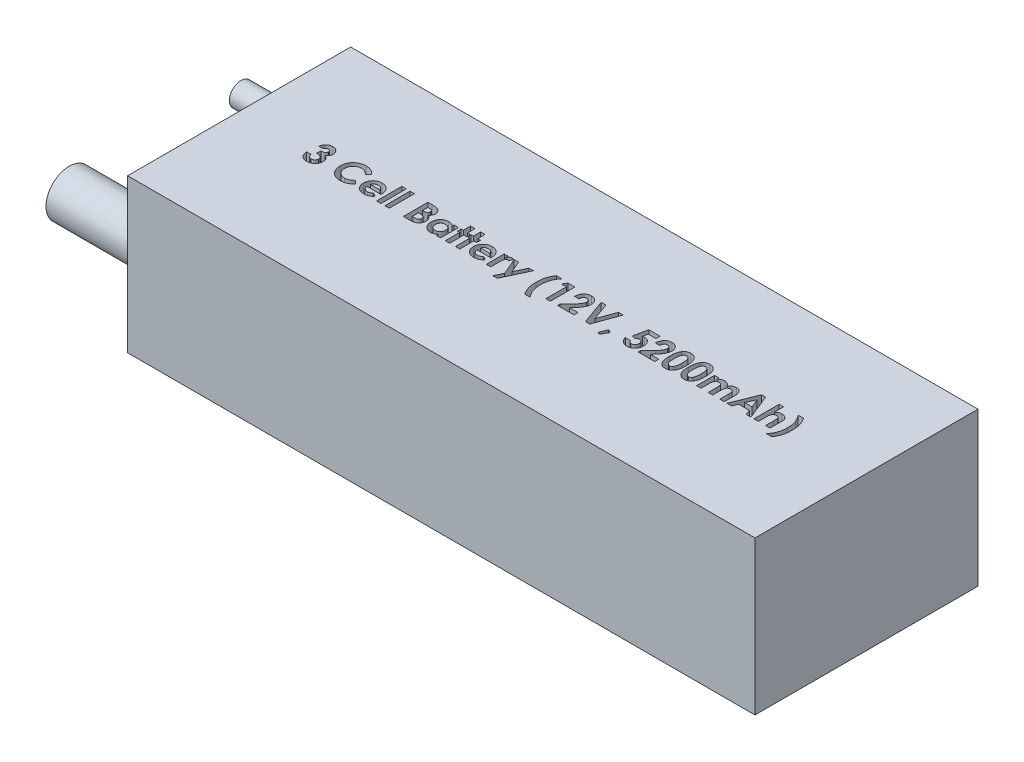
from build123d import *

# Parameters (mm, degrees)
SKETCH1_W           = 135
SKETCH1_H           = 48
BOSS_EXTRUDE1_DEPTH = 33
SKETCH2_R           = 5
SKETCH2_R_2         = 2.5
BOSS_EXTRUDE2_DEPTH = 20
SKETCH3_W           = 0.949786325
SKETCH3_H           = 5.427350428
SKETCH3_W_2         = 0.949786324
CUT_EXTRUDE1_DEPTH  = 5


with BuildPart() as part:
    # Sketch1 → Boss-Extrude1 (new body)
    with BuildSketch(Plane(origin=(0, 0, 0), x_dir=(1, 0, 0), z_dir=(0, 1, 0))):
        with Locations((67.5, 24)):
            Rectangle(SKETCH1_W, SKETCH1_H)
    extrude(amount=BOSS_EXTRUDE1_DEPTH)

    # Sketch2 → Boss-Extrude2 (add)
    with BuildSketch(Plane.ZY):
        with Locations(Location((-7.430420712, 16.069621317, 0), (0, 0, 180))):
            Circle(SKETCH2_R)
        with Locations(Location((-44.389190098, 16.069621317, 0), (0, 0, 180))):
            Circle(SKETCH2_R_2)
    extrude(amount=BOSS_EXTRUDE2_DEPTH)

    # Sketch3 → Cut-Extrude1 (cut)
    # profile 1 of 25: a face of its own
    with BuildSketch(Plane(origin=(0, 33, 0), x_dir=(1, 0, 0), z_dir=(0, 1, 0))):
        with BuildLine():
            Line((16.015700656, 26.091744757), (15.065914331, 26.091744757))
            add(Edge.make_bspline(
                [(15.065914331, 26.091744757), (15.072620184, 26.139221187), (15.085766564, 26.232295584), (15.117224093, 26.367044123), (15.154850692, 26.494862335), (15.201825579, 26.615345445), (15.256919479, 26.728708072), (15.319572149, 26.835339224), (15.390460888, 26.934781217), (15.444797857, 26.994685469), (15.471905584, 27.024570612)],
                knots=[0, 0, 0, 0, 1.111473889, 2.178970933, 3.205615836, 4.199322666, 5.174200091, 6.12565194, 7.064921805, 8, 8, 8, 8], degree=3))
            add(Edge.make_bspline(
                [(15.471905584, 27.024570612), (15.511004888, 27.064001893), (15.588065506, 27.141716803), (15.716842838, 27.241261018), (15.851825264, 27.327409767), (15.995719916, 27.395709118), (16.146287685, 27.45098953), (16.304725937, 27.488121508), (16.470387237, 27.512758903), (16.583430233, 27.515185772), (16.64111799, 27.516424245)],
                knots=[0, 0, 0, 0, 1.01925491, 2.00884431, 2.983262333, 3.955970413, 4.92937149, 5.924503185, 6.940838805, 8, 8, 8, 8], degree=3))
            add(Edge.make_bspline(
                [(16.64111799, 27.516424245), (16.692405374, 27.51521345), (16.793226036, 27.512833272), (16.941407042, 27.493726492), (17.082685229, 27.460215328), (17.218553951, 27.416400234), (17.347015021, 27.356782475), (17.470903699, 27.287578947), (17.586758531, 27.202697943), (17.694850596, 27.106790951), (17.794153774, 27.00305815), (17.880150761, 26.892176317), (17.954083913, 26.777107361), (18.014995052, 26.656895276), (18.06182744, 26.53133665), (18.094330507, 26.401156817), (18.115604553, 26.266643029), (18.117724004, 26.17521582), (18.118798946, 26.128845786)],
                knots=[0, 0, 0, 0, 1.091422571, 2.145516843, 3.172569842, 4.178562979, 5.178154469, 6.181868002, 7.194278174, 8.227918432, 9.254613415, 10.245994977, 11.209837596, 12.161663635, 13.10878368, 14.055455738, 15.013766427, 16, 16, 16, 16], degree=3))
            add(Edge.make_bspline(
                [(18.118798946, 26.128845786), (18.1165931, 26.07142036), (18.112250466, 25.958367351), (18.076616012, 25.792905874), (18.020838401, 25.634695174), (17.940262217, 25.485948857), (17.839521464, 25.347071726), (17.715915934, 25.222706862), (17.572966234, 25.110904392), (17.46565199, 25.05082173), (17.41069932, 25.020055054)],
                knots=[0, 0, 0, 0, 0.992805628, 1.954529043, 2.915727527, 3.886831945, 4.871318353, 5.87440735, 6.911542536, 8, 8, 8, 8], degree=3))
            add(Edge.make_bspline(
                [(17.41069932, 25.020055054), (17.44841799, 25.007671221), (17.522533483, 24.983337544), (17.627879745, 24.935412642), (17.728052003, 24.883038669), (17.821325326, 24.822193918), (17.90862743, 24.755338681), (17.989426111, 24.681901457), (18.064204123, 24.602042372), (18.131740744, 24.515322231), (18.191682135, 24.423127955), (18.245464353, 24.327589176), (18.289730116, 24.227257032), (18.327228728, 24.123277384), (18.355778037, 24.014715716), (18.375879301, 23.901992698), (18.387498325, 23.785365457), (18.389270425, 23.706350572), (18.390166468, 23.666397535)],
                knots=[0, 0, 0, 0, 1.059543567, 2.081955587, 3.086750234, 4.076226789, 5.052108497, 6.020845489, 6.989030705, 7.970690546, 8.952259656, 9.923888338, 10.895517021, 11.877585046, 12.873342345, 13.889638361, 14.932918083, 16, 16, 16, 16], degree=3))
            add(Edge.make_bspline(
                [(18.390166468, 23.666397535), (18.388350068, 23.607682793), (18.384768497, 23.49190928), (18.361998547, 23.321386743), (18.319605001, 23.158808654), (18.263833944, 23.002304307), (18.189441407, 22.853894116), (18.101893898, 22.71017227), (17.994280418, 22.576123002), (17.874686514, 22.448202398), (17.741870511, 22.331902712), (17.597876356, 22.231076118), (17.445870359, 22.144548961), (17.284890819, 22.07430375), (17.114993665, 22.020206903), (16.936557583, 21.981103209), (16.748832833, 21.957178922), (16.620696003, 21.954670914), (16.55525561, 21.953390057)],
                knots=[0, 0, 0, 0, 1.005138573, 1.981928558, 2.936866704, 3.876260664, 4.820238198, 5.773547, 6.751179199, 7.756627054, 8.768222608, 9.766606018, 10.760583154, 11.757261445, 12.767156078, 13.807575856, 14.880313354, 16, 16, 16, 16], degree=3))
            add(Edge.make_bspline(
                [(16.55525561, 21.953390057), (16.493350054, 21.954740504), (16.372301931, 21.957381126), (16.195243717, 21.980237046), (16.026966645, 22.017105499), (15.867041268, 22.069074641), (15.716086324, 22.136469737), (15.572732897, 22.216722174), (15.439841571, 22.314460727), (15.315931676, 22.425273292), (15.203751908, 22.549598698), (15.103489612, 22.684557009), (15.017355591, 22.830661416), (14.944996608, 22.9872877), (14.886978346, 23.154710631), (14.841213711, 23.332589745), (14.809246364, 23.521272563), (14.799510642, 23.651090356), (14.79454681, 23.717278945)],
                knots=[0, 0, 0, 0, 1.066544725, 2.085487077, 3.070979577, 4.031932826, 4.977951092, 5.916076795, 6.857635327, 7.814973522, 8.776389752, 9.738577119, 10.707772778, 11.69409279, 12.707140348, 13.757286496, 14.856535458, 16, 16, 16, 16], degree=3))
            Line((14.79454681, 23.717278945), (15.744333135, 23.717278945))
            add(Edge.make_bspline(
                [(15.744333135, 23.717278945), (15.750351831, 23.683998454), (15.762074822, 23.619175969), (15.784939796, 23.525327421), (15.814736047, 23.438699414), (15.849187927, 23.358522002), (15.886401144, 23.283742483), (15.931363609, 23.217122649), (15.980780709, 23.156853499), (16.052089945, 23.085204869), (16.154031408, 23.011588893), (16.291686157, 22.947613108), (16.444814029, 22.910115438), (16.551865683, 22.905540837), (16.60719705, 22.903176381)],
                knots=[0, 0, 0, 0, 0.928156231, 1.807827665, 2.648129825, 3.438902246, 4.202261636, 4.936546065, 5.639352463, 6.338805438, 7.70633318, 9.064371875, 10.482673459, 12, 12, 12, 12], degree=3))
            add(Edge.make_bspline(
                [(16.60719705, 22.903176381), (16.636557829, 22.90367987), (16.694069026, 22.904666091), (16.778544412, 22.915597036), (16.859019111, 22.933600311), (16.935643011, 22.958066093), (17.008903906, 22.988735482), (17.077402073, 23.028281823), (17.142533674, 23.074260089), (17.203590671, 23.125951867), (17.260008595, 23.182277401), (17.306951625, 23.24464836), (17.349854158, 23.308028402), (17.381585181, 23.376564072), (17.409388392, 23.446567421), (17.426405378, 23.520579349), (17.439254425, 23.597047285), (17.44000116, 23.649378584), (17.440380143, 23.6759378)],
                knots=[0, 0, 0, 0, 1.110435564, 2.175094844, 3.216326037, 4.226890168, 5.215276772, 6.21526065, 7.213097102, 8.228249917, 9.239874822, 10.221364777, 11.178138315, 12.128914389, 13.072518965, 14.022636769, 14.996447288, 16, 16, 16, 16], degree=3))
            add(Edge.make_bspline(
                [(17.440380143, 23.6759378), (17.439374013, 23.704984827), (17.437371038, 23.762810803), (17.421006527, 23.847195656), (17.395163504, 23.928367083), (17.359264388, 24.00596562), (17.311325121, 24.079705253), (17.25475732, 24.151065423), (17.185104378, 24.216331961), (17.108685773, 24.280845955), (17.020070212, 24.3370827), (16.923573397, 24.388980953), (16.816659243, 24.430275941), (16.701937619, 24.467160013), (16.577238459, 24.494099566), (16.443336098, 24.513660308), (16.30044654, 24.528220249), (16.201950911, 24.530309112), (16.151384417, 24.53138151)],
                knots=[0, 0, 0, 0, 0.809814727, 1.612155564, 2.388397, 3.182215007, 3.988903953, 4.837162975, 5.715530372, 6.646997145, 7.623086902, 8.637258368, 9.698941581, 10.815059213, 11.996518529, 13.252603015, 14.589518788, 16, 16, 16, 16], degree=3))
            Line((16.151384417, 24.53138151), (16.151384417, 25.413325954))
            add(Edge.make_bspline(
                [(16.151384417, 25.413325954), (16.214342709, 25.418687684), (16.332125208, 25.428718418), (16.49561363, 25.452175639), (16.633249808, 25.483530077), (16.748341827, 25.52135751), (16.843906866, 25.569937788), (16.927391957, 25.62356827), (16.999293265, 25.685852237), (17.060059516, 25.75493239), (17.108670627, 25.829117996), (17.143074739, 25.907255991), (17.165793417, 25.98692869), (17.16794601, 26.041422414), (17.169012622, 26.068424111)],
                knots=[0, 0, 0, 0, 1.70044513, 3.18119609, 4.440695891, 5.496282586, 6.431922213, 7.318171381, 8.16090191, 8.983045123, 9.787564368, 10.536848927, 11.275007137, 12, 12, 12, 12], degree=3))
            add(Edge.make_bspline(
                [(17.169012622, 26.068424111), (17.167172411, 26.102875344), (17.163580708, 26.170116857), (17.135685601, 26.266353628), (17.087262855, 26.352140733), (17.022336456, 26.427297651), (16.943221381, 26.490074342), (16.850484644, 26.535649149), (16.746138638, 26.562426383), (16.6727256, 26.56520228), (16.634757814, 26.56663792)],
                knots=[0, 0, 0, 0, 1.009664648, 1.970651636, 2.907870547, 3.878035693, 4.867062054, 5.849714035, 6.887914197, 8, 8, 8, 8], degree=3))
            add(Edge.make_bspline(
                [(16.634757814, 26.56663792), (16.600344285, 26.564944016), (16.532057303, 26.561582792), (16.432201296, 26.536495509), (16.337371359, 26.494264189), (16.24953115, 26.436029687), (16.169948662, 26.36609252), (16.1046344, 26.283266462), (16.050309093, 26.192513765), (16.027282026, 26.125466107), (16.015700656, 26.091744757)],
                knots=[0, 0, 0, 0, 0.98818071, 1.960853194, 2.938124878, 3.957524365, 4.978590984, 5.968022688, 6.978025184, 8, 8, 8, 8], degree=3))
        make_face()
    # profile 2 of 25: a face of its own
    with BuildSketch(Plane(origin=(0, 33, 0), x_dir=(1, 0, 0), z_dir=(0, 1, 0))):
        with BuildLine():
            Line((26.056298946, 26.462755041), (25.359859644, 25.79705659))
            add(Edge.make_bspline(
                [(25.359859644, 25.79705659), (25.300781988, 25.858142984), (25.185384819, 25.977463851), (24.999436552, 26.135434163), (24.806057124, 26.267081044), (24.609008348, 26.377953209), (24.404745885, 26.461835904), (24.195631567, 26.522962636), (23.980330138, 26.560229295), (23.834622411, 26.56449326), (23.761335338, 26.56663792)],
                knots=[0, 0, 0, 0, 1.115251505, 2.178435587, 3.19620269, 4.182487026, 5.141301733, 6.088180966, 7.038406374, 8, 8, 8, 8], degree=3))
            add(Edge.make_bspline(
                [(23.761335338, 26.56663792), (23.700131726, 26.564943563), (23.579353141, 26.561599938), (23.402018528, 26.537087864), (23.232388806, 26.495404016), (23.069883305, 26.437955952), (22.914980205, 26.363621206), (22.767354732, 26.272457312), (22.627370851, 26.165287608), (22.496877668, 26.042666597), (22.37750709, 25.908693927), (22.272035584, 25.765745408), (22.183686278, 25.614148527), (22.111179441, 25.455438546), (22.054699417, 25.288880876), (22.014365584, 25.11458765), (21.991037573, 24.932351299), (21.987555711, 24.808468385), (21.985786126, 24.745507444)],
                knots=[0, 0, 0, 0, 1.035432265, 2.043311493, 3.022114605, 3.98653278, 4.95457646, 5.923598177, 6.917315552, 7.932509744, 8.948865224, 9.949768934, 10.933144597, 11.912367597, 12.897413939, 13.903909035, 14.934704909, 16, 16, 16, 16], degree=3))
            add(Edge.make_bspline(
                [(21.985786126, 24.745507444), (21.9862961, 24.701317051), (21.98730127, 24.614216877), (21.998304627, 24.485371546), (22.016022627, 24.360361115), (22.041664964, 24.23937494), (22.073730957, 24.122308175), (22.111351669, 24.00815089), (22.158546298, 23.898480482), (22.210933049, 23.7920232), (22.271858237, 23.691683864), (22.337546828, 23.59600198), (22.40877538, 23.505446571), (22.486005245, 23.42038783), (22.570323338, 23.342155035), (22.659550346, 23.268395632), (22.755191407, 23.200956069), (22.855259813, 23.138143876), (22.960620029, 23.083578389), (23.068413388, 23.0341526), (23.180274254, 22.994011511), (23.294840655, 22.961654131), (23.41170317, 22.934139012), (23.532004822, 22.917197108), (23.654702749, 22.904367202), (23.737625952, 22.90357503), (23.779355837, 22.903176381)],
                knots=[0, 0, 0, 0, 1.103660481, 2.175337485, 3.227646561, 4.255952547, 5.262355991, 6.258840057, 7.255597736, 8.242457506, 9.22035537, 10.185017736, 11.140346927, 12.096287581, 13.051739095, 14.01125915, 14.986044842, 15.97314143, 16.960198552, 17.947847494, 18.933482797, 19.925264591, 20.920966487, 21.929612487, 22.958107872, 24, 24, 24, 24], degree=3))
            add(Edge.make_bspline(
                [(23.779355837, 22.903176381), (23.850136894, 22.905223745), (23.989203264, 22.909246283), (24.193303159, 22.940701956), (24.387790025, 22.992444758), (24.5431841, 23.05355), (24.664931253, 23.11389222), (24.757615561, 23.169705803), (24.85345836, 23.232139423), (24.950867781, 23.303549392), (25.050939489, 23.383078764), (25.151906987, 23.472469378), (25.25635506, 23.568777731), (25.324777957, 23.637514895), (25.359859644, 23.672757711)],
                knots=[0, 0, 0, 0, 1.404581149, 2.759636711, 4.088442092, 5.392261763, 6.066678138, 6.783632037, 7.538459478, 8.336747902, 9.180226004, 10.074962426, 11.012997595, 12, 12, 12, 12], degree=3))
            Line((25.359859644, 23.672757711), (26.035098359, 22.963598056))
            add(Edge.make_bspline(
                [(26.035098359, 22.963598056), (25.987632712, 22.917771464), (25.894989919, 22.828327756), (25.755240839, 22.701326038), (25.615667638, 22.587200876), (25.479642115, 22.481810026), (25.344936029, 22.388223781), (25.211563666, 22.306348675), (25.08103486, 22.234113968), (24.950639138, 22.172737862), (24.81956511, 22.120623174), (24.684705338, 22.075755848), (24.545647544, 22.037799705), (24.401542426, 22.007174082), (24.253734108, 21.982616467), (24.100839302, 21.966040218), (23.943827435, 21.954896558), (23.837323854, 21.953895208), (23.783595955, 21.953390057)],
                knots=[0, 0, 0, 0, 1.244526981, 2.429050516, 3.560637417, 4.644440555, 5.67424972, 6.652764056, 7.595344123, 8.486817594, 9.369275933, 10.254498637, 11.166417451, 12.086725134, 13.032340136, 13.991389299, 14.986715468, 16, 16, 16, 16], degree=3))
            add(Edge.make_bspline(
                [(23.783595955, 21.953390057), (23.684904461, 21.9559059), (23.491792639, 21.960828705), (23.2087923, 21.99730336), (22.939949575, 22.058452477), (22.684610419, 22.144934195), (22.442856025, 22.255410537), (22.21474824, 22.390849344), (22.000654724, 22.550890777), (21.802304931, 22.733658995), (21.622888103, 22.935511149), (21.464304405, 23.152244986), (21.333123964, 23.384925674), (21.224202017, 23.630115775), (21.139026487, 23.888934188), (21.079077354, 24.161660874), (21.042107161, 24.4480325), (21.038062569, 24.643630922), (21.035999801, 24.743387386)],
                knots=[0, 0, 0, 0, 1.078019885, 2.10938526, 3.111377082, 4.085535484, 5.04941344, 6.010039228, 6.978205633, 7.964457913, 8.951525778, 9.924444315, 10.892603023, 11.863865945, 12.85144698, 13.863884204, 14.910567087, 16, 16, 16, 16], degree=3))
            add(Edge.make_bspline(
                [(21.035999801, 24.743387386), (21.036871427, 24.8084477), (21.038598776, 24.937381343), (21.056753377, 25.127311044), (21.082061946, 25.31245853), (21.122211689, 25.490901355), (21.170608245, 25.665043474), (21.23079572, 25.832992165), (21.302677988, 25.995230131), (21.383938113, 26.152028966), (21.47586688, 26.30236147), (21.578561404, 26.444936051), (21.689377929, 26.580853358), (21.810979193, 26.708310195), (21.941598173, 26.828425659), (22.081824598, 26.94054882), (22.230815075, 27.046287651), (22.388972867, 27.142915405), (22.553225389, 27.230320344), (22.721500984, 27.307415234), (22.89338622, 27.371848808), (23.068154349, 27.425294081), (23.246543764, 27.465187198), (23.427281168, 27.495385), (23.611904419, 27.512265765), (23.735862938, 27.515029254), (23.798436366, 27.516424245)],
                knots=[0, 0, 0, 0, 1.071919942, 2.124283339, 3.142214191, 4.149696895, 5.136002878, 6.119640489, 7.086990633, 8.058538607, 9.028339693, 9.988281803, 10.952401235, 11.916291999, 12.888973767, 13.874849856, 14.873389453, 15.898127285, 16.927174885, 17.938320013, 18.946391617, 19.950418109, 20.947802303, 21.956882652, 22.968648068, 24, 24, 24, 24], degree=3))
            add(Edge.make_bspline(
                [(23.798436366, 27.516424245), (23.851817917, 27.515624601), (23.958025998, 27.514033628), (24.116187654, 27.500771138), (24.273084407, 27.479942532), (24.428154519, 27.448516602), (24.582507209, 27.41121005), (24.73411411, 27.362362267), (24.885366904, 27.307912208), (25.033893414, 27.24282828), (25.179900962, 27.171783294), (25.319969091, 27.091180177), (25.456449532, 27.005979155), (25.586317961, 26.911137658), (25.712007092, 26.810095764), (25.832859687, 26.702382056), (25.947815193, 26.586200629), (26.019954885, 26.504111593), (26.056298946, 26.462755041)],
                knots=[0, 0, 0, 0, 0.996412454, 1.982464992, 2.961075852, 3.949442424, 4.934965278, 5.923860011, 6.921385422, 7.934793307, 8.949617135, 9.951082467, 10.950285876, 11.951772932, 12.951063433, 13.960125323, 14.972308753, 16, 16, 16, 16], degree=3))
        make_face()
    # profile 3 of 25: a face of its own
    with BuildSketch(Plane(origin=(0, 33, 0), x_dir=(1, 0, 0), z_dir=(0, 1, 0))):
        with BuildLine():
            Line((30.734208602, 23.785120826), (27.684504075, 23.785120826))
            add(Edge.make_bspline(
                [(27.684504075, 23.785120826), (27.690722176, 23.749684989), (27.702941236, 23.680050775), (27.729475358, 23.578901036), (27.763336877, 23.48357923), (27.803917776, 23.393957934), (27.85053386, 23.309563355), (27.904907661, 23.230791338), (27.966349495, 23.157711459), (28.034504123, 23.090641331), (28.10823553, 23.030545042), (28.187186147, 22.977896894), (28.271437446, 22.934728634), (28.360023517, 22.898342269), (28.453606302, 22.869520583), (28.552323531, 22.849642814), (28.65591352, 22.837900943), (28.726482186, 22.836202615), (28.762553954, 22.835334501)],
                knots=[0, 0, 0, 0, 1.091296461, 2.144483647, 3.168565212, 4.157007626, 5.126487748, 6.090021542, 7.05641414, 8.019231907, 8.98705074, 9.938580405, 10.892824166, 11.854447369, 12.841318655, 13.858982407, 14.905600794, 16, 16, 16, 16], degree=3))
            add(Edge.make_bspline(
                [(28.762553954, 22.835334501), (28.806095028, 22.836484027), (28.891840224, 22.838747783), (29.017457575, 22.858823937), (29.138947852, 22.889148085), (29.255161329, 22.934242637), (29.367444155, 22.990377429), (29.473947813, 23.060314471), (29.576515795, 23.142009977), (29.639094351, 23.204980841), (29.670999133, 23.237085636)],
                knots=[0, 0, 0, 0, 1.021034703, 2.010718019, 2.977989445, 3.954245119, 4.929443971, 5.918328161, 6.938689359, 8, 8, 8, 8], degree=3))
            Line((29.670999133, 23.237085636), (30.466021169, 22.858655147))
            add(Edge.make_bspline(
                [(30.466021169, 22.858655147), (30.440990364, 22.824066417), (30.391392745, 22.755530119), (30.310426296, 22.659081848), (30.225932651, 22.569091697), (30.137848795, 22.486151548), (30.046063014, 22.410497745), (29.950830636, 22.34120869), (29.850759878, 22.280144764), (29.747851637, 22.224351734), (29.639978608, 22.176520627), (29.527439324, 22.135731948), (29.410710453, 22.098859329), (29.28831796, 22.070764413), (29.161281007, 22.048524707), (29.029295697, 22.03273157), (28.892379424, 22.022976905), (28.799318231, 22.021820502), (28.751953661, 22.021231937)],
                knots=[0, 0, 0, 0, 1.028154879, 2.037251081, 3.030720504, 4.000128189, 4.949298328, 5.894184978, 6.834267904, 7.770992897, 8.712077017, 9.673380525, 10.653304757, 11.658697181, 12.695551717, 13.758623199, 14.859225354, 16, 16, 16, 16], degree=3))
            add(Edge.make_bspline(
                [(28.751953661, 22.021231937), (28.679084047, 22.022717529), (28.536373108, 22.025626976), (28.327632562, 22.052630805), (28.129386939, 22.097406065), (27.941076463, 22.158271153), (27.763515138, 22.238632137), (27.596615088, 22.336920288), (27.438708743, 22.451251223), (27.294621023, 22.584024446), (27.163352859, 22.728540205), (27.048055065, 22.883740263), (26.951575513, 23.048540293), (26.872344565, 23.221849617), (26.810763519, 23.404111836), (26.766367158, 23.595406488), (26.739151656, 23.795642205), (26.736212247, 23.932025081), (26.73471775, 24.001366819)],
                knots=[0, 0, 0, 0, 1.103565453, 2.161269334, 3.182010356, 4.179077853, 5.15417608, 6.128274628, 7.109042802, 8.101804412, 9.090965879, 10.063106201, 11.02526161, 11.978650795, 12.945248442, 13.93468508, 14.949922959, 16, 16, 16, 16], degree=3))
            add(Edge.make_bspline(
                [(26.73471775, 24.001366819), (26.736226956, 24.07247062), (26.73919625, 24.212364155), (26.766132832, 24.417223407), (26.81088626, 24.612686842), (26.872647444, 24.799023633), (26.950676449, 24.976816563), (27.048383537, 25.144510155), (27.163295643, 25.302688229), (27.294090916, 25.450610811), (27.438789036, 25.584127101), (27.59254446, 25.703116799), (27.757084786, 25.802266912), (27.930548923, 25.882380143), (28.11182733, 25.947470121), (28.303015334, 25.990782065), (28.502658285, 26.019863442), (28.639129809, 26.022541656), (28.708492456, 26.023902877)],
                knots=[0, 0, 0, 0, 1.079208495, 2.12329425, 3.130605359, 4.119693003, 5.099659317, 6.073216462, 7.060498243, 8.06384408, 9.066070512, 10.045757761, 11.010926815, 11.975797609, 12.942977511, 13.929384301, 14.947594487, 16, 16, 16, 16], degree=3))
            add(Edge.make_bspline(
                [(28.708492456, 26.023902877), (28.781711165, 26.022394237), (28.925468554, 26.019432178), (29.135662914, 25.992647613), (29.335224863, 25.94759932), (29.525004648, 25.88726052), (29.702578703, 25.804869533), (29.871848868, 25.709000098), (30.028755085, 25.592197813), (30.174969807, 25.46007434), (30.306958476, 25.313487925), (30.422331197, 25.154250182), (30.520499182, 24.983915178), (30.600065309, 24.801792169), (30.661583122, 24.608427905), (30.706020581, 24.404073508), (30.733028493, 24.187951711), (30.735913207, 24.03996073), (30.73738869, 23.964265791)],
                knots=[0, 0, 0, 0, 1.080001299, 2.120471247, 3.119684163, 4.095710327, 5.052285597, 6.002875087, 6.961153713, 7.931888285, 8.906493152, 9.865905668, 10.82813294, 11.801621613, 12.7925306, 13.817193356, 14.883530496, 16, 16, 16, 16], degree=3))
            Line((30.73738869, 23.964265791), (30.734208602, 23.785120826))
        make_face()
        with BuildLine():
            add(Edge.make_bspline(
                [(29.787602365, 24.53138151), (29.769679316, 24.579748558), (29.734043626, 24.67591485), (29.653544086, 24.808600869), (29.546723771, 24.92351235), (29.422484081, 25.025244395), (29.280532456, 25.107816477), (29.12534204, 25.167601347), (28.958874411, 25.203449104), (28.844353652, 25.207653417), (28.785874601, 25.209800313)],
                knots=[0, 0, 0, 0, 0.954238005, 1.897273737, 2.851915805, 3.847685534, 4.862635127, 5.880135777, 6.917509367, 8, 8, 8, 8], degree=3))
            add(Edge.make_bspline(
                [(28.785874601, 25.209800313), (28.722005956, 25.207737958), (28.597156053, 25.203706483), (28.417068569, 25.160830265), (28.247196551, 25.096838791), (28.147049637, 25.030862223), (28.096855504, 24.997794437)],
                knots=[0, 0, 0, 0, 1.044195649, 2.041185066, 3.018232172, 4, 4, 4, 4], degree=3))
            add(Edge.make_bspline(
                [(28.096855504, 24.997794437), (28.065538113, 24.972609287), (27.998771038, 24.918915835), (27.912060445, 24.811802496), (27.826649789, 24.682112288), (27.778089122, 24.583603412), (27.752345955, 24.53138151)],
                knots=[0, 0, 0, 0, 0.82159062, 1.751589201, 2.808063854, 4, 4, 4, 4], degree=3))
            Line((27.752345955, 24.53138151), (29.787602365, 24.53138151))
        make_face(mode=Mode.SUBTRACT)
    # profile 4 of 25: a face of its own
    with BuildSketch(Plane(origin=(0, 33, 0), x_dir=(1, 0, 0), z_dir=(0, 1, 0))):
        with Locations((31.958542537, 24.802749031)):
            Rectangle(SKETCH3_W, SKETCH3_H)
    # profile 5 of 25: a face of its own
    with BuildSketch(Plane(origin=(0, 33, 0), x_dir=(1, 0, 0), z_dir=(0, 1, 0))):
        with Locations((33.722431425, 24.802749031)):
            Rectangle(SKETCH3_W_2, SKETCH3_H)
    # profile 6 of 25: a face of its own
    with BuildSketch(Plane(origin=(0, 33, 0), x_dir=(1, 0, 0), z_dir=(0, 1, 0))):
        with BuildLine():
            Line((37.250209203, 22.089073817), (37.250209203, 27.380740484))
            Line((37.250209203, 27.380740484), (38.098232707, 27.380740484))
            add(Edge.make_bspline(
                [(38.098232707, 27.380740484), (38.157599655, 27.380747259), (38.272473573, 27.380760369), (38.438206658, 27.374940367), (38.591910098, 27.367411543), (38.733094748, 27.358988539), (38.862000916, 27.344474021), (38.978432577, 27.329177304), (39.082622364, 27.310730407), (39.147037247, 27.294182968), (39.177342616, 27.286397869)],
                knots=[0, 0, 0, 0, 1.311965854, 2.538629056, 3.664479157, 4.713267157, 5.663616078, 6.530575999, 7.308677837, 8, 8, 8, 8], degree=3))
            add(Edge.make_bspline(
                [(39.177342616, 27.286397869), (39.217136643, 27.275416848), (39.295225298, 27.253868561), (39.407073171, 27.210350863), (39.513176481, 27.161977856), (39.613405678, 27.106793302), (39.707145315, 27.04413097), (39.79403915, 26.973493551), (39.875961267, 26.897716429), (39.950002799, 26.814687717), (40.016924145, 26.726952503), (40.075066796, 26.634533775), (40.125585308, 26.538844676), (40.166013349, 26.438681024), (40.196475119, 26.334504097), (40.218754731, 26.226758748), (40.233194936, 26.115104045), (40.234559346, 26.039141701), (40.235251938, 26.000582231)],
                knots=[0, 0, 0, 0, 1.099996261, 2.158545794, 3.195537121, 4.207578794, 5.205712374, 6.197378256, 7.190519799, 8.17788031, 9.159561366, 10.129234751, 11.085776129, 12.040971148, 13.00380137, 13.975669004, 14.972423361, 16, 16, 16, 16], degree=3))
            add(Edge.make_bspline(
                [(40.235251938, 26.000582231), (40.233441015, 25.951043433), (40.229876436, 25.853532396), (40.207105662, 25.710306325), (40.164406914, 25.574937102), (40.10853664, 25.444929922), (40.032570535, 25.320769714), (39.936108273, 25.202515512), (39.820712228, 25.086526093), (39.732197091, 25.016998259), (39.686156719, 24.980833967)],
                knots=[0, 0, 0, 0, 0.986156485, 1.941127874, 2.875419072, 3.804401753, 4.751181392, 5.761612777, 6.835722519, 8, 8, 8, 8], degree=3))
            add(Edge.make_bspline(
                [(39.686156719, 24.980833967), (39.723465628, 24.961788092), (39.796618076, 24.924444402), (39.900473061, 24.863062523), (39.996631441, 24.797775109), (40.08552436, 24.729895771), (40.165287188, 24.656547004), (40.239213466, 24.581955264), (40.303656055, 24.501846757), (40.36128256, 24.4190767), (40.411370581, 24.332446575), (40.454991725, 24.24210268), (40.49183694, 24.147736381), (40.523038422, 24.049827925), (40.546308495, 23.948040554), (40.561481077, 23.842337864), (40.573098155, 23.733080355), (40.574001854, 23.658656868), (40.57446134, 23.620816272)],
                knots=[0, 0, 0, 0, 1.164658916, 2.283573913, 3.35186032, 4.395461096, 5.390182219, 6.362969632, 7.312859996, 8.245001507, 9.165155236, 10.092416118, 11.032087915, 11.979892451, 12.947605196, 13.931445124, 14.948243989, 16, 16, 16, 16], degree=3))
            add(Edge.make_bspline(
                [(40.57446134, 23.620816272), (40.571479585, 23.548542897), (40.565595103, 23.405911681), (40.522570647, 23.196496299), (40.44797991, 22.997951523), (40.347819932, 22.811066454), (40.224403568, 22.64125111), (40.082510142, 22.492494342), (39.923568194, 22.366575041), (39.776925036, 22.281589281), (39.650090253, 22.224555889), (39.545035371, 22.189294249), (39.432208656, 22.156627919), (39.309543391, 22.133688948), (39.179263332, 22.112692679), (39.040098239, 22.099729148), (38.892308209, 22.090944082), (38.790799628, 22.089709843), (38.738490453, 22.089073817)],
                knots=[0, 0, 0, 0, 1.284142165, 2.534249414, 3.780121997, 5.041676246, 6.291546858, 7.49970053, 8.684500223, 9.883330709, 10.50184324, 11.153274765, 11.851151195, 12.587658647, 13.369265475, 14.195992086, 15.070362669, 16, 16, 16, 16], degree=3))
            Line((38.738490453, 22.089073817), (37.250209203, 22.089073817))
        make_face()
        with BuildLine():
            Line((38.199995528, 26.430954159), (38.199995528, 25.277642193))
            Line((38.199995528, 25.277642193), (38.45228252, 25.277642193))
            add(Edge.make_bspline(
                [(38.45228252, 25.277642193), (38.486570589, 25.277941198), (38.552761631, 25.278518409), (38.64836757, 25.285952686), (38.737265654, 25.298636023), (38.819118711, 25.316332469), (38.894689232, 25.338804375), (38.963494451, 25.365842918), (39.025231844, 25.398832879), (39.096956415, 25.447972883), (39.172774459, 25.520284597), (39.239516231, 25.624753851), (39.278826689, 25.744893096), (39.283204813, 25.829624594), (39.285465613, 25.873378705)],
                knots=[0, 0, 0, 0, 1.065314748, 2.056525647, 2.977365736, 3.853934255, 4.656397591, 5.425096493, 6.14721249, 6.826394842, 8.123232004, 9.372140726, 10.643011755, 12, 12, 12, 12], degree=3))
            add(Edge.make_bspline(
                [(39.285465613, 25.873378705), (39.283656559, 25.9143617), (39.280158827, 25.993600673), (39.24057825, 26.104859249), (39.179101789, 26.203457117), (39.106520187, 26.270939295), (39.038170504, 26.317027632), (38.979645311, 26.34737484), (38.915409518, 26.37454135), (38.844219587, 26.395313526), (38.766482053, 26.410900236), (38.68257453, 26.422346807), (38.592352248, 26.430137831), (38.530035527, 26.430676213), (38.497863784, 26.430954159)],
                knots=[0, 0, 0, 0, 1.347982417, 2.606269829, 3.849316587, 5.153353503, 5.842674298, 6.568177932, 7.326619318, 8.142485038, 9.012069166, 9.942760135, 10.937925643, 12, 12, 12, 12], degree=3))
            Line((38.497863784, 26.430954159), (38.199995528, 26.430954159))
        make_face(mode=Mode.SUBTRACT)
        with BuildLine():
            Line((38.199995528, 24.395697749), (38.199995528, 23.038860142))
            Line((38.199995528, 23.038860142), (38.473483108, 23.038860142))
            add(Edge.make_bspline(
                [(38.473483108, 23.038860142), (38.527551951, 23.039169035), (38.631506048, 23.039762921), (38.780420108, 23.046938475), (38.915820217, 23.059871147), (39.037347616, 23.076016545), (39.145188447, 23.097891035), (39.238978183, 23.125701646), (39.320003027, 23.156298161), (39.387777151, 23.194088491), (39.443144728, 23.238067063), (39.493108161, 23.28301422), (39.533845231, 23.334865012), (39.566077161, 23.391393629), (39.593973839, 23.451195858), (39.610799146, 23.516606956), (39.623609344, 23.585688293), (39.624314323, 23.63347036), (39.624675015, 23.6579173)],
                knots=[0, 0, 0, 0, 1.753078804, 3.370512758, 4.83203934, 6.162291463, 7.344201807, 8.395507345, 9.331626367, 10.147333109, 10.898971645, 11.62040215, 12.321813352, 13.025280112, 13.727906689, 14.453419512, 15.208716525, 16, 16, 16, 16], degree=3))
            add(Edge.make_bspline(
                [(39.624675015, 23.6579173), (39.623879586, 23.68587276), (39.622330306, 23.740322476), (39.609677311, 23.819906548), (39.586682686, 23.894203558), (39.557719833, 23.965113384), (39.517416486, 24.030097205), (39.469517335, 24.091403865), (39.411642932, 24.146957332), (39.34655979, 24.200117687), (39.270646748, 24.246662458), (39.183868191, 24.287048291), (39.085752689, 24.320777051), (38.97599632, 24.347631913), (38.855080248, 24.370423262), (38.722121917, 24.384032214), (38.578228651, 24.394153789), (38.478450718, 24.395171402), (38.426841815, 24.395697749)],
                knots=[0, 0, 0, 0, 0.845221588, 1.646264278, 2.427170338, 3.19324141, 3.95557735, 4.731569926, 5.540061037, 6.376114724, 7.268642756, 8.224665384, 9.265483498, 10.400594375, 11.639216012, 12.983232105, 14.439614077, 16, 16, 16, 16], degree=3))
            Line((38.426841815, 24.395697749), (38.199995528, 24.395697749))
        make_face(mode=Mode.SUBTRACT)
    # profile 7 of 25: a face of its own
    with BuildSketch(Plane(origin=(0, 33, 0), x_dir=(1, 0, 0), z_dir=(0, 1, 0))):
        with BuildLine():
            Line((44.305764758, 25.956060997), (45.255551083, 25.956060997))
            Line((45.255551083, 25.956060997), (45.255551083, 22.089073817))
            Line((45.255551083, 22.089073817), (44.305764758, 22.089073817))
            Line((44.305764758, 22.089073817), (44.305764758, 22.510965511))
            add(Edge.make_bspline(
                [(44.305764758, 22.510965511), (44.258703196, 22.469899024), (44.167365997, 22.390197082), (44.023448126, 22.286781787), (43.879109711, 22.201477533), (43.733657201, 22.133537348), (43.584855052, 22.083370514), (43.431631949, 22.047048554), (43.271781315, 22.025628605), (43.163117057, 22.022712759), (43.107931559, 22.021231937)],
                knots=[0, 0, 0, 0, 1.129196829, 2.191548051, 3.199897424, 4.157751732, 5.089409408, 6.034969131, 7.002052659, 8, 8, 8, 8], degree=3))
            add(Edge.make_bspline(
                [(43.107931559, 22.021231937), (43.045983384, 22.022625577), (42.923570279, 22.025379489), (42.743942637, 22.054368856), (42.570494291, 22.098743543), (42.403366033, 22.161539273), (42.242861937, 22.242910227), (42.08775366, 22.340733325), (41.94070023, 22.458442741), (41.800477478, 22.59094549), (41.672090368, 22.736699457), (41.559853144, 22.893681597), (41.465245506, 23.059665464), (41.387738531, 23.234100745), (41.326769285, 23.416859416), (41.283306938, 23.60852113), (41.257664103, 23.80915434), (41.254490242, 23.945817826), (41.252880143, 24.015147201)],
                knots=[0, 0, 0, 0, 0.980476535, 1.937477201, 2.874147792, 3.812856188, 4.758993464, 5.720109578, 6.712210464, 7.737600662, 8.772720504, 9.783789959, 10.789002326, 11.793715968, 12.802552247, 13.835794126, 14.902098527, 16, 16, 16, 16], degree=3))
            add(Edge.make_bspline(
                [(41.252880143, 24.015147201), (41.254569948, 24.086937861), (41.257884689, 24.227763239), (41.282131821, 24.434417785), (41.324792125, 24.630831736), (41.382962516, 24.817277153), (41.457788622, 24.993786247), (41.548921821, 25.160648196), (41.657601893, 25.317426849), (41.782836409, 25.461453725), (41.918058928, 25.593461313), (42.062723118, 25.708384387), (42.214566748, 25.806016885), (42.373751178, 25.885722892), (42.540253675, 25.947315661), (42.71341689, 25.992345004), (42.894009546, 26.019364191), (43.017030728, 26.022377417), (43.079310765, 26.023902877)],
                knots=[0, 0, 0, 0, 1.136281865, 2.228943489, 3.287578264, 4.313574083, 5.316051562, 6.317280042, 7.318008486, 8.329309503, 9.333984563, 10.305318864, 11.248632312, 12.186624717, 13.117503092, 14.05354244, 15.014596925, 16, 16, 16, 16], degree=3))
            add(Edge.make_bspline(
                [(43.079310765, 26.023902877), (43.13700226, 26.022704324), (43.251152934, 26.02033282), (43.418937977, 25.994582824), (43.581665269, 25.955637783), (43.738447125, 25.900148109), (43.890569521, 25.830081108), (44.035415856, 25.742281933), (44.176154776, 25.640440743), (44.262027645, 25.560900617), (44.305764758, 25.520388921)],
                knots=[0, 0, 0, 0, 1.017011718, 2.012299608, 2.98747302, 3.965332399, 4.941441765, 5.936729654, 6.94912688, 8, 8, 8, 8], degree=3))
            Line((44.305764758, 25.520388921), (44.305764758, 25.956060997))
        make_face()
        with BuildLine():
            add(Edge.make_bspline(
                [(43.278596289, 25.141958433), (43.240750104, 25.140797181), (43.166574052, 25.138521204), (43.057488016, 25.124831041), (42.953234491, 25.100708365), (42.854557003, 25.065072292), (42.759984897, 25.021662362), (42.670954263, 24.967292139), (42.586730306, 24.903027691), (42.507808355, 24.830424859), (42.435859368, 24.750621072), (42.373835142, 24.66353785), (42.321124571, 24.571521592), (42.276545127, 24.474295634), (42.244636359, 24.370709495), (42.219364628, 24.262111681), (42.206250236, 24.147615004), (42.20387301, 24.069589062), (42.202666468, 24.029987613)],
                knots=[0, 0, 0, 0, 1.04836806, 2.054732945, 3.03993516, 4.00574415, 4.955904794, 5.917688631, 6.888591924, 7.88601754, 8.884115178, 9.859153345, 10.841239365, 11.818093293, 12.814750328, 13.83810466, 14.90274714, 16, 16, 16, 16], degree=3))
            add(Edge.make_bspline(
                [(42.202666468, 24.029987613), (42.20385458, 23.990026956), (42.20619574, 23.911284944), (42.219576675, 23.795822446), (42.243939025, 23.685638274), (42.279482774, 23.581623189), (42.322889937, 23.482373687), (42.375726216, 23.388347811), (42.440626331, 23.301208058), (42.512638388, 23.218892408), (42.593179411, 23.145387727), (42.677879941, 23.080122318), (42.767896922, 23.025514793), (42.862253732, 22.981380646), (42.960632763, 22.945415026), (43.06426739, 22.921595522), (43.172142379, 22.906368164), (43.245683608, 22.904247656), (43.282836406, 22.903176381)],
                knots=[0, 0, 0, 0, 1.099136573, 2.165835871, 3.191374663, 4.196217796, 5.183857741, 6.167377911, 7.154730987, 8.166690795, 9.170734848, 10.148332609, 11.103258353, 12.059567475, 13.009337315, 13.978056681, 14.978520572, 16, 16, 16, 16], degree=3))
            add(Edge.make_bspline(
                [(43.282836406, 22.903176381), (43.321387521, 22.904344143), (43.396968663, 22.906633591), (43.507834382, 22.920198816), (43.613488406, 22.94440994), (43.713491158, 22.980250038), (43.809370085, 23.023348371), (43.900259965, 23.076656158), (43.985174507, 23.140773137), (44.064543763, 23.2140323), (44.137270386, 23.294487733), (44.200152358, 23.382712913), (44.254924856, 23.475886157), (44.298000906, 23.57621042), (44.33220933, 23.681930496), (44.356753085, 23.793702506), (44.370103465, 23.911646954), (44.37242415, 23.992148635), (44.373606639, 24.033167701)],
                knots=[0, 0, 0, 0, 1.050008698, 2.058587853, 3.036635738, 3.995319155, 4.947022481, 5.895997462, 6.858296291, 7.838991643, 8.833936038, 9.806048392, 10.784806122, 11.771666913, 12.772873988, 13.80724452, 14.882696879, 16, 16, 16, 16], degree=3))
            add(Edge.make_bspline(
                [(44.373606639, 24.033167701), (44.372438844, 24.073481258), (44.3701578, 24.152225345), (44.356695508, 24.267707168), (44.331977506, 24.377284487), (44.298473148, 24.481158717), (44.254630762, 24.579092352), (44.199816822, 24.669999541), (44.137624629, 24.757029878), (44.064092817, 24.835311764), (43.985153522, 24.908040474), (43.898990175, 24.970218509), (43.808317388, 25.023805265), (43.712578066, 25.067802058), (43.610885706, 25.100053375), (43.505051126, 25.12502439), (43.393423087, 25.138512987), (43.317496503, 25.140791209), (43.278596289, 25.141958433)],
                knots=[0, 0, 0, 0, 1.106611376, 2.161533483, 3.185006901, 4.184773755, 5.152708835, 6.122342771, 7.094156588, 8.082475533, 9.064254463, 10.03606828, 10.992420271, 11.951521816, 12.920622147, 13.915721683, 14.932141191, 16, 16, 16, 16], degree=3))
        make_face(mode=Mode.SUBTRACT)
    # profile 8 of 25: a face of its own
    with BuildSketch(Plane(origin=(0, 33, 0), x_dir=(1, 0, 0), z_dir=(0, 1, 0))):
        Polygon((46.273179288, 27.516424245), (47.222965613, 27.516424245), (47.222965613, 25.956060997), (47.833542536, 25.956060997), (47.833542536, 25.141958433), (47.222965613, 25.141958433), (47.222965613, 22.089073817), (46.273179288, 22.089073817), (46.273179288, 25.141958433), (45.798286126, 25.141958433), (45.798286126, 25.956060997), (46.273179288, 25.956060997), align=None)
    # profile 9 of 25: a face of its own
    with BuildSketch(Plane(origin=(0, 33, 0), x_dir=(1, 0, 0), z_dir=(0, 1, 0))):
        Polygon((48.444119459, 27.516424245), (49.393905784, 27.516424245), (49.393905784, 25.956060997), (50.004482707, 25.956060997), (50.004482707, 25.141958433), (49.393905784, 25.141958433), (49.393905784, 22.089073817), (48.444119459, 22.089073817), (48.444119459, 25.141958433), (47.969226297, 25.141958433), (47.969226297, 25.956060997), (48.444119459, 25.956060997), align=None)
    # profile 10 of 25: a face of its own
    with BuildSketch(Plane(origin=(0, 33, 0), x_dir=(1, 0, 0), z_dir=(0, 1, 0))):
        with BuildLine():
            Line((54.411024841, 23.785120826), (51.361320314, 23.785120826))
            add(Edge.make_bspline(
                [(51.361320314, 23.785120826), (51.367538415, 23.749684989), (51.379757475, 23.680050775), (51.406291597, 23.578901036), (51.440153117, 23.48357923), (51.480734015, 23.393957934), (51.5273501, 23.309563355), (51.5817239, 23.230791338), (51.643165734, 23.157711459), (51.711320362, 23.090641331), (51.785051769, 23.030545042), (51.864002386, 22.977896894), (51.948253685, 22.934728634), (52.036839756, 22.898342269), (52.130422541, 22.869520583), (52.22913977, 22.849642814), (52.33272976, 22.837900943), (52.403298425, 22.836202615), (52.439370194, 22.835334501)],
                knots=[0, 0, 0, 0, 1.091296461, 2.144483647, 3.168565212, 4.157007626, 5.126487748, 6.090021542, 7.05641414, 8.019231907, 8.98705074, 9.938580405, 10.892824166, 11.854447369, 12.841318655, 13.858982407, 14.905600794, 16, 16, 16, 16], degree=3))
            add(Edge.make_bspline(
                [(52.439370194, 22.835334501), (52.482911267, 22.836484027), (52.568656464, 22.838747783), (52.694273815, 22.858823937), (52.815764091, 22.889148085), (52.931977568, 22.934242637), (53.044260395, 22.990377429), (53.150764052, 23.060314471), (53.253332034, 23.142009977), (53.31591059, 23.204980841), (53.347815373, 23.237085636)],
                knots=[0, 0, 0, 0, 1.021034703, 2.010718019, 2.977989445, 3.954245119, 4.929443971, 5.918328161, 6.938689359, 8, 8, 8, 8], degree=3))
            Line((53.347815373, 23.237085636), (54.142837408, 22.858655147))
            add(Edge.make_bspline(
                [(54.142837408, 22.858655147), (54.117806603, 22.824066417), (54.068208984, 22.755530119), (53.987242535, 22.659081848), (53.90274889, 22.569091697), (53.814665034, 22.486151548), (53.722879254, 22.410497745), (53.627646876, 22.34120869), (53.527576118, 22.280144764), (53.424667876, 22.224351734), (53.316794847, 22.176520627), (53.204255564, 22.135731948), (53.087526692, 22.098859329), (52.965134199, 22.070764413), (52.838097246, 22.048524707), (52.706111936, 22.03273157), (52.569195663, 22.022976905), (52.47613447, 22.021820502), (52.4287699, 22.021231937)],
                knots=[0, 0, 0, 0, 1.028154879, 2.037251081, 3.030720504, 4.000128189, 4.949298328, 5.894184978, 6.834267904, 7.770992897, 8.712077017, 9.673380525, 10.653304757, 11.658697181, 12.695551717, 13.758623199, 14.859225354, 16, 16, 16, 16], degree=3))
            add(Edge.make_bspline(
                [(52.4287699, 22.021231937), (52.355900286, 22.022717529), (52.213189347, 22.025626976), (52.004448801, 22.052630805), (51.806203178, 22.097406065), (51.617892703, 22.158271153), (51.440331378, 22.238632137), (51.273431328, 22.336920288), (51.115524982, 22.451251223), (50.971437262, 22.584024446), (50.840169098, 22.728540205), (50.724871304, 22.883740263), (50.628391753, 23.048540293), (50.549160804, 23.221849617), (50.487579759, 23.404111836), (50.443183397, 23.595406488), (50.415967895, 23.795642205), (50.413028486, 23.932025081), (50.411533989, 24.001366819)],
                knots=[0, 0, 0, 0, 1.103565453, 2.161269334, 3.182010356, 4.179077853, 5.15417608, 6.128274628, 7.109042802, 8.101804412, 9.090965879, 10.063106201, 11.02526161, 11.978650795, 12.945248442, 13.93468508, 14.949922959, 16, 16, 16, 16], degree=3))
            add(Edge.make_bspline(
                [(50.411533989, 24.001366819), (50.413043195, 24.07247062), (50.416012489, 24.212364155), (50.442949072, 24.417223407), (50.487702499, 24.612686842), (50.549463683, 24.799023633), (50.627492688, 24.976816563), (50.725199777, 25.144510155), (50.840111882, 25.302688229), (50.970907155, 25.450610811), (51.115605275, 25.584127101), (51.269360699, 25.703116799), (51.433901025, 25.802266912), (51.607365162, 25.882380143), (51.78864357, 25.947470121), (51.979831574, 25.990782065), (52.179474524, 26.019863442), (52.315946049, 26.022541656), (52.385308695, 26.023902877)],
                knots=[0, 0, 0, 0, 1.079208495, 2.12329425, 3.130605359, 4.119693003, 5.099659317, 6.073216462, 7.060498243, 8.06384408, 9.066070512, 10.045757761, 11.010926815, 11.975797609, 12.942977511, 13.929384301, 14.947594487, 16, 16, 16, 16], degree=3))
            add(Edge.make_bspline(
                [(52.385308695, 26.023902877), (52.458527404, 26.022394237), (52.602284793, 26.019432178), (52.812479153, 25.992647613), (53.012041103, 25.94759932), (53.201820888, 25.88726052), (53.379394943, 25.804869533), (53.548665108, 25.709000098), (53.705571325, 25.592197813), (53.851786046, 25.46007434), (53.983774715, 25.313487925), (54.099147436, 25.154250182), (54.197315422, 24.983915178), (54.276881548, 24.801792169), (54.338399362, 24.608427905), (54.38283682, 24.404073508), (54.409844733, 24.187951711), (54.412729446, 24.03996073), (54.414204929, 23.964265791)],
                knots=[0, 0, 0, 0, 1.080001299, 2.120471247, 3.119684163, 4.095710327, 5.052285597, 6.002875087, 6.961153713, 7.931888285, 8.906493152, 9.865905668, 10.82813294, 11.801621613, 12.7925306, 13.817193356, 14.883530496, 16, 16, 16, 16], degree=3))
            Line((54.414204929, 23.964265791), (54.411024841, 23.785120826))
        make_face()
        with BuildLine():
            add(Edge.make_bspline(
                [(53.464418605, 24.53138151), (53.446495556, 24.579748558), (53.410859866, 24.67591485), (53.330360325, 24.808600869), (53.22354001, 24.92351235), (53.09930032, 25.025244395), (52.957348695, 25.107816477), (52.80215828, 25.167601347), (52.63569065, 25.203449104), (52.521169891, 25.207653417), (52.46269084, 25.209800313)],
                knots=[0, 0, 0, 0, 0.954238005, 1.897273737, 2.851915805, 3.847685534, 4.862635127, 5.880135777, 6.917509367, 8, 8, 8, 8], degree=3))
            add(Edge.make_bspline(
                [(52.46269084, 25.209800313), (52.398822195, 25.207737958), (52.273972292, 25.203706483), (52.093884808, 25.160830265), (51.92401279, 25.096838791), (51.823865876, 25.030862223), (51.773671743, 24.997794437)],
                knots=[0, 0, 0, 0, 1.044195649, 2.041185066, 3.018232172, 4, 4, 4, 4], degree=3))
            add(Edge.make_bspline(
                [(51.773671743, 24.997794437), (51.742354352, 24.972609287), (51.675587277, 24.918915835), (51.588876684, 24.811802496), (51.503466028, 24.682112288), (51.454905361, 24.583603412), (51.429162194, 24.53138151)],
                knots=[0, 0, 0, 0, 0.82159062, 1.751589201, 2.808063854, 4, 4, 4, 4], degree=3))
            Line((51.429162194, 24.53138151), (53.464418605, 24.53138151))
        make_face(mode=Mode.SUBTRACT)
    # profile 11 of 25: a face of its own
    with BuildSketch(Plane(origin=(0, 33, 0), x_dir=(1, 0, 0), z_dir=(0, 1, 0))):
        with BuildLine():
            Line((55.092623733, 25.956060997), (55.906726297, 25.956060997))
            Line((55.906726297, 25.956060997), (55.906726297, 25.480107805))
            add(Edge.make_bspline(
                [(55.906726297, 25.480107805), (55.929755696, 25.522405896), (55.974767611, 25.60507927), (56.057458274, 25.716051902), (56.152456657, 25.809509957), (56.256349174, 25.887408195), (56.369450703, 25.948122222), (56.488732587, 25.99138862), (56.613174371, 26.019505784), (56.698064338, 26.022426625), (56.740969419, 26.023902877)],
                knots=[0, 0, 0, 0, 1.09866127, 2.147379032, 3.14564304, 4.131443017, 5.102343063, 6.064490016, 7.021754664, 8, 8, 8, 8], degree=3))
            add(Edge.make_bspline(
                [(56.740969419, 26.023902877), (56.772123862, 26.022444032), (56.835565432, 26.019473303), (56.932259313, 26.002204408), (57.030348317, 25.970978963), (57.094899333, 25.942864599), (57.127880143, 25.928500233)],
                knots=[0, 0, 0, 0, 0.931404136, 1.896671404, 2.925354185, 4, 4, 4, 4], degree=3))
            Line((57.127880143, 25.928500233), (56.833191975, 25.123937933))
            add(Edge.make_bspline(
                [(56.833191975, 25.123937933), (56.806851061, 25.136664589), (56.757340283, 25.160585804), (56.685459229, 25.188815301), (56.620224193, 25.20603956), (56.578866377, 25.208609571), (56.559704395, 25.209800313)],
                knots=[0, 0, 0, 0, 1.214386998, 2.282580073, 3.20428172, 4, 4, 4, 4], degree=3))
            add(Edge.make_bspline(
                [(56.559704395, 25.209800313), (56.541611758, 25.209011264), (56.506020422, 25.20745907), (56.453488607, 25.194157289), (56.404014576, 25.171218779), (56.355214179, 25.141832272), (56.310937226, 25.10098283), (56.266687622, 25.053692347), (56.227692501, 24.995305956), (56.186541339, 24.930318937), (56.151502597, 24.850774885), (56.121457954, 24.755815679), (56.094687936, 24.644342575), (56.076266509, 24.515763707), (56.05846146, 24.371323296), (56.047863457, 24.209961168), (56.039964632, 24.032187566), (56.039481672, 23.908095175), (56.039229969, 23.843422442)],
                knots=[0, 0, 0, 0, 0.544232178, 1.070598461, 1.618251235, 2.182094276, 2.777567932, 3.425210017, 4.127676488, 4.886675562, 5.738955394, 6.734782583, 7.883056018, 9.186093582, 10.642914445, 12.264202625, 14.053029461, 16, 16, 16, 16], degree=3))
            Line((56.039229969, 23.843422442), (56.042410058, 23.654737212))
            Line((56.042410058, 23.654737212), (56.042410058, 22.089073817))
            Line((56.042410058, 22.089073817), (55.092623733, 22.089073817))
            Line((55.092623733, 22.089073817), (55.092623733, 25.956060997))
        make_face()
    # profile 12 of 25: a face of its own
    with BuildSketch(Plane(origin=(0, 33, 0), x_dir=(1, 0, 0), z_dir=(0, 1, 0))):
        Polygon((57.227522905, 25.956060997), (58.178369259, 25.956060997), (59.234158522, 23.468172041), (60.402310899, 25.956060997), (61.367997664, 25.956060997), (58.882228768, 20.66439433), (57.916542002, 20.66439433), (58.733824654, 22.403902543), align=None)
    # profile 13 of 25: a face of its own
    with BuildSketch(Plane(origin=(0, 33, 0), x_dir=(1, 0, 0), z_dir=(0, 1, 0))):
        with BuildLine():
            Line((64.761151711, 27.516424245), (65.947324587, 27.516424245))
            add(Edge.make_bspline(
                [(65.947324587, 27.516424245), (65.896879047, 27.457926262), (65.796715523, 27.341773992), (65.658501143, 27.159752792), (65.528512048, 26.975186425), (65.408607113, 26.786273014), (65.298560039, 26.593336711), (65.197462293, 26.397335318), (65.107264629, 26.197286279), (65.026393519, 25.993261957), (64.955000968, 25.783557667), (64.893579034, 25.566999856), (64.84183344, 25.343379702), (64.799282139, 25.112429895), (64.766598537, 24.874358602), (64.74381329, 24.628535844), (64.727958125, 24.375765372), (64.726771128, 24.204564207), (64.726170741, 24.117970051)],
                knots=[0, 0, 0, 0, 1.00236213, 1.990267575, 2.964862165, 3.931797803, 4.893137898, 5.846900052, 6.793123604, 7.740135921, 8.694427184, 9.667077551, 10.660503013, 11.672460941, 12.714089686, 13.778281025, 14.87624668, 16, 16, 16, 16], degree=3))
            add(Edge.make_bspline(
                [(64.726170741, 24.117970051), (64.727168337, 24.024312516), (64.729134887, 23.839686455), (64.745304267, 23.56700349), (64.772048336, 23.302924059), (64.807174578, 23.04694394), (64.855463707, 22.80025236), (64.912311702, 22.561548438), (64.980787651, 22.33189113), (65.035296342, 22.183510331), (65.062200055, 22.110274405)],
                knots=[0, 0, 0, 0, 1.097990858, 2.164457195, 3.201156713, 4.209415668, 5.192484095, 6.147015238, 7.085427113, 8, 8, 8, 8], degree=3))
            add(Edge.make_bspline(
                [(65.062200055, 22.110274405), (65.085274489, 22.053828057), (65.132394272, 21.938560243), (65.216213525, 21.766756122), (65.310035368, 21.591220718), (65.416345558, 21.412742905), (65.530657386, 21.229012874), (65.660321265, 21.04406851), (65.798484944, 20.85406588), (65.897099605, 20.728397777), (65.947324587, 20.66439433)],
                knots=[0, 0, 0, 0, 0.860028042, 1.756243877, 2.695094802, 3.667075869, 4.686284936, 5.746781471, 6.852423585, 8, 8, 8, 8], degree=3))
            Line((65.947324587, 20.66439433), (64.761151711, 20.66439433))
            add(Edge.make_bspline(
                [(64.761151711, 20.66439433), (64.716434753, 20.737569709), (64.628655299, 20.881213085), (64.508377799, 21.098841935), (64.39523781, 21.310712296), (64.294901781, 21.520554767), (64.202672364, 21.725605904), (64.124317803, 21.928745871), (64.051865992, 22.126598104), (63.992188694, 22.324263236), (63.941208466, 22.524214098), (63.896105379, 22.73055069), (63.859744274, 22.945737038), (63.828616209, 23.16943732), (63.805791366, 23.401810886), (63.788989221, 23.64253023), (63.777850836, 23.891725525), (63.776878513, 24.060716297), (63.776384417, 24.146590844)],
                knots=[0, 0, 0, 0, 1.119871376, 2.19830916, 3.246961562, 4.256259542, 5.235550337, 6.182491613, 7.09917337, 7.986748165, 8.877687696, 9.793695483, 10.744317876, 11.727190303, 12.742913882, 13.793068013, 14.878522868, 16, 16, 16, 16], degree=3))
            add(Edge.make_bspline(
                [(63.776384417, 24.146590844), (63.776787752, 24.230702261), (63.777582974, 24.396537244), (63.790065069, 24.641133647), (63.808018697, 24.877948767), (63.831467407, 25.106908584), (63.865153306, 25.327687046), (63.903659663, 25.540745556), (63.950498068, 25.745846644), (64.004822122, 25.944659008), (64.06807104, 26.139665408), (64.139151941, 26.334280269), (64.219859111, 26.529459361), (64.310319419, 26.72538625), (64.408833506, 26.92290279), (64.516904794, 27.120975043), (64.634834646, 27.319345458), (64.718726027, 27.450232062), (64.761151711, 27.516424245)],
                knots=[0, 0, 0, 0, 1.13127193, 2.230428031, 3.293392423, 4.325815098, 5.325330466, 6.296707414, 7.23754678, 8.15420938, 9.068070667, 9.994306547, 10.940496973, 11.908145907, 12.896524899, 13.908929949, 14.942500703, 16, 16, 16, 16], degree=3))
        make_face()
    # profile 14 of 25: a face of its own
    with BuildSketch(Plane(origin=(0, 33, 0), x_dir=(1, 0, 0), z_dir=(0, 1, 0))):
        Polygon((67.39638475, 27.380740484), (68.864525442, 27.380740484), (68.864525442, 22.089073817), (67.914739117, 22.089073817), (67.914739117, 26.498796039), (66.829269032, 26.498796039), align=None)
    # profile 15 of 25: a face of its own
    with BuildSketch(Plane(origin=(0, 33, 0), x_dir=(1, 0, 0), z_dir=(0, 1, 0))):
        with BuildLine():
            Line((71.510358776, 25.616851595), (70.560572451, 25.616851595))
            add(Edge.make_bspline(
                [(70.560572451, 25.616851595), (70.564674432, 25.688697906), (70.572689458, 25.829081283), (70.604571203, 26.032992634), (70.647291649, 26.225666438), (70.704307754, 26.4064287), (70.775952221, 26.575213738), (70.860381452, 26.732596949), (70.959752424, 26.877749706), (71.071950195, 27.009972002), (71.195069955, 27.128589844), (71.326555617, 27.233763875), (71.468418432, 27.320550838), (71.61806645, 27.391968474), (71.775474189, 27.449027846), (71.942130973, 27.487176654), (72.116593798, 27.5130114), (72.23602773, 27.515272044), (72.296900576, 27.516424245)],
                knots=[0, 0, 0, 0, 1.199038563, 2.342849363, 3.436047546, 4.486744587, 5.497670872, 6.488682221, 7.459191391, 8.424610317, 9.374430501, 10.305433194, 11.225809216, 12.140057399, 13.06607119, 14.010487599, 14.985989317, 16, 16, 16, 16], degree=3))
            add(Edge.make_bspline(
                [(72.296900576, 27.516424245), (72.371621131, 27.514092766), (72.517493165, 27.509541174), (72.729456801, 27.470714584), (72.927407662, 27.405771111), (73.111201856, 27.315027953), (73.27927471, 27.199748283), (73.431598354, 27.062296143), (73.563566278, 26.899787715), (73.676015196, 26.71898471), (73.769446809, 26.527539773), (73.83491979, 26.32957777), (73.877954477, 26.130351809), (73.882544392, 25.996203131), (73.884824587, 25.929560262)],
                knots=[0, 0, 0, 0, 1.075374347, 2.099382735, 3.09057751, 4.06680945, 5.040638231, 6.016817125, 7.011024321, 8.044445721, 9.0776792, 10.070479129, 11.0414456, 12, 12, 12, 12], degree=3))
            add(Edge.make_bspline(
                [(73.884824587, 25.929560262), (73.8839368, 25.889249945), (73.882149903, 25.808115234), (73.869725371, 25.685338503), (73.851086118, 25.560276048), (73.822982666, 25.433035099), (73.787935358, 25.303579987), (73.745417908, 25.171523299), (73.694444081, 25.037613747), (73.635864528, 24.900344201), (73.565978972, 24.759269003), (73.484606957, 24.612273379), (73.389588684, 24.459487726), (73.282071854, 24.300049366), (73.161534285, 24.13420976), (73.02738755, 23.962468466), (72.881176707, 23.784220324), (72.777406758, 23.665071445), (72.724092416, 23.603855802)],
                knots=[0, 0, 0, 0, 0.728284026, 1.46585585, 2.227944881, 3.01186502, 3.81876927, 4.650621989, 5.517437689, 6.406905708, 7.346299482, 8.360816762, 9.441613733, 10.596154504, 11.834900912, 13.145207542, 14.533280747, 16, 16, 16, 16], degree=3))
            Line((72.724092416, 23.603855802), (72.171817109, 22.971018262))
            Line((72.171817109, 22.971018262), (73.952666468, 22.971018262))
            Line((73.952666468, 22.971018262), (73.952666468, 22.089073817))
            Line((73.952666468, 22.089073817), (70.42488869, 22.089073817))
            Line((70.42488869, 22.089073817), (70.42488869, 22.570327156))
            Line((70.42488869, 22.570327156), (71.991612114, 24.237753371))
            add(Edge.make_bspline(
                [(71.991612114, 24.237753371), (72.036972783, 24.286392712), (72.124822948, 24.38059269), (72.249824678, 24.51893538), (72.362940203, 24.65021929), (72.461823978, 24.77584233), (72.551665298, 24.891729799), (72.628458144, 25.00137469), (72.692905112, 25.103785774), (72.762871437, 25.227275656), (72.829316446, 25.374559314), (72.890283763, 25.544236128), (72.927447562, 25.706408085), (72.932577341, 25.812082817), (72.935038263, 25.862778411)],
                knots=[0, 0, 0, 0, 1.246127091, 2.413378631, 3.493388633, 4.492180848, 5.408488754, 6.240484944, 6.999099869, 7.674939598, 8.898438119, 10.020720584, 11.050475521, 12, 12, 12, 12], degree=3))
            add(Edge.make_bspline(
                [(72.935038263, 25.862778411), (72.933198291, 25.911822487), (72.929633051, 26.006853248), (72.890453955, 26.142033998), (72.829756339, 26.264426369), (72.744224826, 26.370373136), (72.640619376, 26.457436621), (72.520893547, 26.522191994), (72.386023455, 26.559555548), (72.291476952, 26.56423213), (72.242839077, 26.56663792)],
                knots=[0, 0, 0, 0, 1.062038974, 2.057870785, 3.028805853, 4.01125022, 4.991535629, 5.949134679, 6.94496649, 8, 8, 8, 8], degree=3))
            add(Edge.make_bspline(
                [(72.242839077, 26.56663792), (72.217712132, 26.565749192), (72.168245705, 26.563999589), (72.095533923, 26.552352956), (72.026343439, 26.53182698), (71.959904124, 26.504325062), (71.896925035, 26.467871072), (71.837565026, 26.422935722), (71.781198665, 26.37066092), (71.72808447, 26.311210124), (71.679743618, 26.244863017), (71.63680745, 26.172225546), (71.601306388, 26.093342799), (71.570049962, 26.009256148), (71.54594351, 25.919062434), (71.528391023, 25.823301456), (71.515047039, 25.722129005), (71.511949959, 25.652582459), (71.510358776, 25.616851595)],
                knots=[0, 0, 0, 0, 0.903469896, 1.778625579, 2.63899355, 3.493148037, 4.358286772, 5.247621495, 6.164656832, 7.118446693, 8.109501108, 9.111810964, 10.146451449, 11.215617525, 12.33435995, 13.498009769, 14.714554818, 16, 16, 16, 16], degree=3))
        make_face()
    # profile 16 of 25: a face of its own
    with BuildSketch(Plane(origin=(0, 33, 0), x_dir=(1, 0, 0), z_dir=(0, 1, 0))):
        Polygon((74.529322451, 27.380740484), (75.543770568, 27.380740484), (76.903788263, 23.621876301), (78.266986046, 27.380740484), (79.278254075, 27.380740484), (77.359600896, 22.089073817), (76.444795541, 22.089073817), align=None)
    # profile 17 of 25: a face of its own
    with BuildSketch(Plane(origin=(0, 33, 0), x_dir=(1, 0, 0), z_dir=(0, 1, 0))):
        Polygon((80.465486981, 23.067480935), (81.143905784, 22.71661121), (80.27892181, 21.207129373), (79.801908589, 21.439275807), align=None)
    # profile 18 of 25: a face of its own
    with BuildSketch(Plane(origin=(0, 33, 0), x_dir=(1, 0, 0), z_dir=(0, 1, 0))):
        with BuildLine():
            Line((84.772386353, 27.380740484), (87.181833135, 27.380740484))
            Line((87.181833135, 27.380740484), (87.181833135, 26.498796039))
            Line((87.181833135, 26.498796039), (85.525007213, 26.498796039))
            Line((85.525007213, 26.498796039), (85.318301484, 25.498128304))
            add(Edge.make_bspline(
                [(85.318301484, 25.498128304), (85.346468098, 25.505973062), (85.402018449, 25.521444536), (85.485705122, 25.536960467), (85.56680917, 25.5470174), (85.620029152, 25.548358861), (85.645850562, 25.549009715)],
                knots=[0, 0, 0, 0, 1.05461699, 2.079921384, 3.068411212, 4, 4, 4, 4], degree=3))
            add(Edge.make_bspline(
                [(85.645850562, 25.549009715), (85.702118121, 25.547720376), (85.813033874, 25.545178806), (85.975289545, 25.521051015), (86.130658936, 25.483050475), (86.278666599, 25.428853864), (86.419167949, 25.358315576), (86.552333303, 25.27298402), (86.678326097, 25.172709325), (86.794908171, 25.057428708), (86.902028651, 24.93084798), (86.995163798, 24.79393753), (87.074707026, 24.648649567), (87.137972959, 24.494080983), (87.187907827, 24.331202575), (87.223991878, 24.159909963), (87.24533018, 23.980000141), (87.248207519, 23.857260533), (87.249675015, 23.79466109)],
                knots=[0, 0, 0, 0, 1.01440847, 1.999622559, 2.951875003, 3.895578053, 4.836219714, 5.782137149, 6.743708247, 7.735272588, 8.734977101, 9.730283169, 10.717124674, 11.717316708, 12.737475749, 13.78628267, 14.87096371, 16, 16, 16, 16], degree=3))
            add(Edge.make_bspline(
                [(87.249675015, 23.79466109), (87.247881712, 23.731350999), (87.244343, 23.606421681), (87.221256151, 23.422731394), (87.180507448, 23.246797568), (87.124535028, 23.078149231), (87.050794946, 22.91802591), (86.962112406, 22.764768846), (86.856988024, 22.619515617), (86.736453432, 22.483755244), (86.605416519, 22.359667658), (86.465893139, 22.25050757), (86.318863485, 22.158650241), (86.164324011, 22.084413989), (86.003161358, 22.025679588), (85.835326611, 21.982923748), (85.660004116, 21.958405649), (85.540982921, 21.955080292), (85.480485979, 21.953390057)],
                knots=[0, 0, 0, 0, 1.06808661, 2.107647099, 3.116961351, 4.110378221, 5.100014249, 6.085620622, 7.093190682, 8.119403071, 9.144090782, 10.133780668, 11.103064255, 12.062861538, 13.020824475, 13.992378307, 14.979551724, 16, 16, 16, 16], degree=3))
            add(Edge.make_bspline(
                [(85.480485979, 21.953390057), (85.426385365, 21.954772775), (85.319687631, 21.957499784), (85.162526554, 21.974261422), (85.011005824, 22.003896154), (84.865929849, 22.046785285), (84.725772189, 22.099572014), (84.592153105, 22.165591795), (84.464338338, 22.243587521), (84.342690833, 22.332135769), (84.22918719, 22.431881937), (84.125593092, 22.541071302), (84.031281367, 22.658327588), (83.948270137, 22.78509738), (83.87681962, 22.921193383), (83.813455843, 23.065011674), (83.761591957, 23.218054175), (83.735272528, 23.32415174), (83.721897237, 23.378069544)],
                knots=[0, 0, 0, 0, 1.054957082, 2.080596141, 3.077793124, 4.061112343, 5.027190972, 5.994718051, 6.962465889, 7.943658696, 8.924948258, 9.904494768, 10.875059, 11.855380583, 12.854004648, 13.869083016, 14.917087635, 16, 16, 16, 16], degree=3))
            Line((83.721897237, 23.378069544), (84.807367323, 23.378069544))
            add(Edge.make_bspline(
                [(84.807367323, 23.378069544), (84.827209742, 23.340706701), (84.86577122, 23.26809628), (84.939123675, 23.171695036), (85.021237092, 23.089488197), (85.111370763, 23.020672584), (85.210108698, 22.969117097), (85.313427512, 22.930019802), (85.422625157, 22.907426922), (85.496993574, 22.904602588), (85.534547477, 22.903176381)],
                knots=[0, 0, 0, 0, 1.104910296, 2.147267069, 3.153527244, 4.136738762, 5.099945312, 6.05603338, 7.018353, 8, 8, 8, 8], degree=3))
            add(Edge.make_bspline(
                [(85.534547477, 22.903176381), (85.560722044, 22.90416119), (85.612220945, 22.906098817), (85.688096431, 22.916349351), (85.760522917, 22.935763629), (85.830038875, 22.962647892), (85.896831043, 22.996175604), (85.959941932, 23.038502156), (86.020469558, 23.087221586), (86.077492445, 23.143127298), (86.129138744, 23.205449162), (86.174426899, 23.272418254), (86.214920756, 23.342546505), (86.244915174, 23.418611872), (86.269478066, 23.498343016), (86.287567174, 23.582341374), (86.298377455, 23.670705048), (86.299378198, 23.731028451), (86.29988869, 23.761800179)],
                knots=[0, 0, 0, 0, 0.978869489, 1.925942215, 2.855067702, 3.774946051, 4.70828698, 5.642468714, 6.60995405, 7.609372294, 8.622401667, 9.629904756, 10.629323, 11.642352373, 12.678539694, 13.745912462, 14.850161547, 16, 16, 16, 16], degree=3))
            add(Edge.make_bspline(
                [(86.29988869, 23.761800179), (86.299296206, 23.791857626), (86.29814292, 23.850365175), (86.288602712, 23.936275214), (86.271535464, 24.017788294), (86.248281192, 24.095528743), (86.218512947, 24.169024485), (86.182134162, 24.238713), (86.138989424, 24.30424204), (86.088847096, 24.364277497), (86.035375833, 24.419343726), (85.977930515, 24.46750421), (85.917028694, 24.507474069), (85.854562819, 24.542368918), (85.788039476, 24.567764629), (85.718954508, 24.585253718), (85.647380568, 24.598086508), (85.598561537, 24.598840481), (85.573768565, 24.59922339)],
                knots=[0, 0, 0, 0, 1.166249705, 2.270133367, 3.348514167, 4.393962215, 5.415026464, 6.420877785, 7.440098956, 8.453121383, 9.451844239, 10.415694839, 11.355045125, 12.27538808, 13.187007209, 14.108269027, 15.039275622, 16, 16, 16, 16], degree=3))
            add(Edge.make_bspline(
                [(85.573768565, 24.59922339), (85.546837634, 24.598201511), (85.492862273, 24.596153445), (85.412668395, 24.579488887), (85.333441432, 24.552519379), (85.254740801, 24.51531067), (85.177347743, 24.46661621), (85.099219815, 24.40950319), (85.022972128, 24.33982181), (84.974491727, 24.287922959), (84.94941126, 24.261074018)],
                knots=[0, 0, 0, 0, 0.88288272, 1.769486374, 2.674910571, 3.623812639, 4.617874466, 5.670434592, 6.794841017, 8, 8, 8, 8], degree=3))
            Line((84.94941126, 24.261074018), (84.150149107, 24.4444591))
            Line((84.150149107, 24.4444591), (84.772386353, 27.380740484))
        make_face()
    # profile 19 of 25: a face of its own
    with BuildSketch(Plane(origin=(0, 33, 0), x_dir=(1, 0, 0), z_dir=(0, 1, 0))):
        with BuildLine():
            Line((88.877880143, 25.616851595), (87.928093818, 25.616851595))
            add(Edge.make_bspline(
                [(87.928093818, 25.616851595), (87.9321958, 25.688697906), (87.940210825, 25.829081283), (87.972092571, 26.032992634), (88.014813016, 26.225666438), (88.071829121, 26.4064287), (88.143473588, 26.575213738), (88.22790282, 26.732596949), (88.327273792, 26.877749706), (88.439471562, 27.009972002), (88.562591322, 27.128589844), (88.694076984, 27.233763875), (88.835939799, 27.320550838), (88.985587817, 27.391968474), (89.142995556, 27.449027846), (89.309652341, 27.487176654), (89.484115166, 27.5130114), (89.603549097, 27.515272044), (89.664421943, 27.516424245)],
                knots=[0, 0, 0, 0, 1.199038563, 2.342849363, 3.436047546, 4.486744587, 5.497670872, 6.488682221, 7.459191391, 8.424610317, 9.374430501, 10.305433194, 11.225809216, 12.140057399, 13.06607119, 14.010487599, 14.985989317, 16, 16, 16, 16], degree=3))
            add(Edge.make_bspline(
                [(89.664421943, 27.516424245), (89.739142498, 27.514092766), (89.885014533, 27.509541174), (90.096978169, 27.470714584), (90.294929029, 27.405771111), (90.478723223, 27.315027953), (90.646796077, 27.199748283), (90.799119721, 27.062296143), (90.931087645, 26.899787715), (91.043536564, 26.71898471), (91.136968176, 26.527539773), (91.202441158, 26.32957777), (91.245475844, 26.130351809), (91.25006576, 25.996203131), (91.252345955, 25.929560262)],
                knots=[0, 0, 0, 0, 1.075374347, 2.099382735, 3.09057751, 4.06680945, 5.040638231, 6.016817125, 7.011024321, 8.044445721, 9.0776792, 10.070479129, 11.0414456, 12, 12, 12, 12], degree=3))
            add(Edge.make_bspline(
                [(91.252345955, 25.929560262), (91.251458168, 25.889249945), (91.249671271, 25.808115234), (91.237246738, 25.685338503), (91.218607485, 25.560276048), (91.190504034, 25.433035099), (91.155456726, 25.303579987), (91.112939275, 25.171523299), (91.061965449, 25.037613747), (91.003385895, 24.900344201), (90.93350034, 24.759269003), (90.852128324, 24.612273379), (90.757110051, 24.459487726), (90.649593222, 24.300049366), (90.529055652, 24.13420976), (90.394908918, 23.962468466), (90.248698074, 23.784220324), (90.144928126, 23.665071445), (90.091613784, 23.603855802)],
                knots=[0, 0, 0, 0, 0.728284026, 1.46585585, 2.227944881, 3.01186502, 3.81876927, 4.650621989, 5.517437689, 6.406905708, 7.346299482, 8.360816762, 9.441613733, 10.596154504, 11.834900912, 13.145207542, 14.533280747, 16, 16, 16, 16], degree=3))
            Line((90.091613784, 23.603855802), (89.539338476, 22.971018262))
            Line((89.539338476, 22.971018262), (91.320187835, 22.971018262))
            Line((91.320187835, 22.971018262), (91.320187835, 22.089073817))
            Line((91.320187835, 22.089073817), (87.792410058, 22.089073817))
            Line((87.792410058, 22.089073817), (87.792410058, 22.570327156))
            Line((87.792410058, 22.570327156), (89.359133482, 24.237753371))
            add(Edge.make_bspline(
                [(89.359133482, 24.237753371), (89.404494151, 24.286392712), (89.492344315, 24.38059269), (89.617346046, 24.51893538), (89.73046157, 24.65021929), (89.829345345, 24.77584233), (89.919186665, 24.891729799), (89.995979512, 25.00137469), (90.06042648, 25.103785774), (90.130392805, 25.227275656), (90.196837813, 25.374559314), (90.25780513, 25.544236128), (90.294968929, 25.706408085), (90.300098709, 25.812082817), (90.30255963, 25.862778411)],
                knots=[0, 0, 0, 0, 1.246127091, 2.413378631, 3.493388633, 4.492180848, 5.408488754, 6.240484944, 6.999099869, 7.674939598, 8.898438119, 10.020720584, 11.050475521, 12, 12, 12, 12], degree=3))
            add(Edge.make_bspline(
                [(90.30255963, 25.862778411), (90.300719659, 25.911822487), (90.297154419, 26.006853248), (90.257975322, 26.142033998), (90.197277707, 26.264426369), (90.111746194, 26.370373136), (90.008140744, 26.457436621), (89.888414914, 26.522191994), (89.753544823, 26.559555548), (89.658998319, 26.56423213), (89.610360445, 26.56663792)],
                knots=[0, 0, 0, 0, 1.062038974, 2.057870785, 3.028805853, 4.01125022, 4.991535629, 5.949134679, 6.94496649, 8, 8, 8, 8], degree=3))
            add(Edge.make_bspline(
                [(89.610360445, 26.56663792), (89.585233499, 26.565749192), (89.535767072, 26.563999589), (89.463055291, 26.552352956), (89.393864806, 26.53182698), (89.327425491, 26.504325062), (89.264446403, 26.467871072), (89.205086394, 26.422935722), (89.148720033, 26.37066092), (89.095605837, 26.311210124), (89.047264986, 26.244863017), (89.004328818, 26.172225546), (88.968827755, 26.093342799), (88.937571329, 26.009256148), (88.913464878, 25.919062434), (88.895912391, 25.823301456), (88.882568407, 25.722129005), (88.879471327, 25.652582459), (88.877880143, 25.616851595)],
                knots=[0, 0, 0, 0, 0.903469896, 1.778625579, 2.63899355, 3.493148037, 4.358286772, 5.247621495, 6.164656832, 7.118446693, 8.109501108, 9.111810964, 10.146451449, 11.215617525, 12.33435995, 13.498009769, 14.714554818, 16, 16, 16, 16], degree=3))
        make_face()
    # profile 20 of 25: a face of its own
    with BuildSketch(Plane(origin=(0, 33, 0), x_dir=(1, 0, 0), z_dir=(0, 1, 0))):
        with BuildLine():
            add(Edge.make_bspline(
                [(93.712674147, 27.516424245), (93.758647747, 27.515741754), (93.849044128, 27.514399794), (93.982180982, 27.499865277), (94.110428582, 27.477907674), (94.23428865, 27.447284476), (94.352869626, 27.406755765), (94.46703457, 27.358243591), (94.575424586, 27.299203393), (94.679421995, 27.232514457), (94.778986737, 27.157013127), (94.871725842, 27.070937713), (94.959332924, 26.976268813), (95.039911611, 26.871575203), (95.115246344, 26.757809183), (95.185089585, 26.634952714), (95.248906668, 26.502404494), (95.307412828, 26.35992533), (95.359729222, 26.205379522), (95.403795255, 26.036994361), (95.441589252, 25.854731394), (95.473490052, 25.658136941), (95.497601901, 25.44694968), (95.513853773, 25.221309915), (95.525006576, 24.981652645), (95.525916791, 24.817249727), (95.526384417, 24.732787092)],
                knots=[0, 0, 0, 0, 0.879237366, 1.728815576, 2.559023295, 3.367336655, 4.166867292, 4.954216142, 5.737608147, 6.525189134, 7.316157332, 8.124696809, 8.942788509, 9.781158001, 10.649253743, 11.551476218, 12.482711956, 13.461909668, 14.496590415, 15.601789533, 16.789733467, 18.056700938, 19.410929216, 20.8549011, 22.384193279, 24, 24, 24, 24], degree=3))
            add(Edge.make_bspline(
                [(95.526384417, 24.732787092), (95.525879039, 24.647267734), (95.5248971, 24.481105157), (95.514317398, 24.23925586), (95.496098652, 24.011977814), (95.472617016, 23.799294534), (95.440453599, 23.601318333), (95.402785767, 23.417536587), (95.358024164, 23.248015912), (95.303984486, 23.093138274), (95.245832464, 22.950408885), (95.181840815, 22.818119103), (95.113124903, 22.695910613), (95.041260864, 22.581939733), (94.962308848, 22.479566268), (94.880111671, 22.385308984), (94.791090321, 22.302758262), (94.698992943, 22.227659808), (94.600445635, 22.162759673), (94.496464691, 22.105999086), (94.385196311, 22.059959507), (94.268668728, 22.019916741), (94.144895706, 21.991170356), (94.015843981, 21.968361043), (93.880056586, 21.955755218), (93.787607058, 21.954191383), (93.740234911, 21.953390057)],
                knots=[0, 0, 0, 0, 1.643780988, 3.193836972, 4.651895693, 6.025988579, 7.305620092, 8.505800249, 9.631074763, 10.672816429, 11.65661981, 12.592235626, 13.49536222, 14.350718032, 15.179365177, 15.97804903, 16.751647189, 17.51006938, 18.259804725, 19.016521909, 19.783502495, 20.571750527, 21.382245291, 22.22305063, 23.089471752, 24, 24, 24, 24], degree=3))
            add(Edge.make_bspline(
                [(93.740234911, 21.953390057), (93.692864042, 21.95420684), (93.600065208, 21.955806907), (93.46391063, 21.968267314), (93.334174996, 21.991262757), (93.20942273, 22.020137435), (93.090522089, 22.059870909), (92.976902948, 22.107287958), (92.869438939, 22.163694388), (92.767832512, 22.228745734), (92.67243058, 22.303341722), (92.581750597, 22.386684465), (92.495993153, 22.47856271), (92.416462831, 22.580005569), (92.341857155, 22.689658992), (92.272954144, 22.808775168), (92.209795206, 22.937180666), (92.150404719, 23.07505447), (92.098801903, 23.225364846), (92.052877793, 23.389454045), (92.01525797, 23.568689887), (91.985001591, 23.763014791), (91.960844916, 23.972017069), (91.942875126, 24.195797603), (91.932236659, 24.434460623), (91.931265017, 24.598505604), (91.930764758, 24.682965711)],
                knots=[0, 0, 0, 0, 0.917216111, 1.796812873, 2.643793957, 3.46689424, 4.273913431, 5.068098542, 5.848489301, 6.620921603, 7.401012384, 8.190319798, 9.003608147, 9.831726257, 10.68377682, 11.569763213, 12.493818149, 13.453288342, 14.474581811, 15.568529029, 16.750744269, 18.018426408, 19.375425659, 20.823733699, 22.36466933, 24, 24, 24, 24], degree=3))
            add(Edge.make_bspline(
                [(91.930764758, 24.682965711), (91.93167093, 24.80031638), (91.933419401, 25.026746007), (91.955577303, 25.353870985), (91.988099484, 25.65624136), (92.035866863, 25.933351342), (92.094930567, 26.186227265), (92.170564715, 26.413203316), (92.256668691, 26.617420216), (92.330040341, 26.738399537), (92.365376804, 26.796664295)],
                knots=[0, 0, 0, 0, 1.288568992, 2.486310467, 3.599230591, 4.627010532, 5.572937695, 6.447898582, 7.252493626, 8, 8, 8, 8], degree=3))
            add(Edge.make_bspline(
                [(92.365376804, 26.796664295), (92.406464361, 26.853903576), (92.486798631, 26.965817647), (92.627265348, 27.112739904), (92.778178547, 27.238395012), (92.942637899, 27.339939285), (93.11804241, 27.420017106), (93.305898018, 27.47657517), (93.505511004, 27.509528533), (93.642588571, 27.514091349), (93.712674147, 27.516424245)],
                knots=[0, 0, 0, 0, 1.058512271, 2.069600068, 3.047294572, 4.004278952, 4.967380941, 5.939006123, 6.946246673, 8, 8, 8, 8], degree=3))
        make_face()
        with BuildLine():
            add(Edge.make_bspline(
                [(93.735994793, 26.56663792), (93.694434277, 26.564668034), (93.612953605, 26.560806012), (93.494721266, 26.528022895), (93.383235553, 26.477387603), (93.298431349, 26.416455946), (93.234956246, 26.358045646), (93.190605736, 26.305186224), (93.147836659, 26.246198918), (93.110060857, 26.178421936), (93.074390639, 26.104290583), (93.039530084, 26.023468348), (93.010953582, 25.933970063), (92.982877928, 25.837319893), (92.958281034, 25.73084572), (92.93767423, 25.613677234), (92.919263862, 25.485052477), (92.90642241, 25.344887201), (92.894450324, 25.193328053), (92.885868165, 25.030037417), (92.88228018, 24.855059346), (92.881139669, 24.734554546), (92.880551083, 24.672365417)],
                knots=[0, 0, 0, 0, 1.076674018, 2.110852608, 3.161083442, 4.239746716, 4.804137807, 5.395870207, 6.026861976, 6.692161227, 7.405688833, 8.16177676, 8.973626916, 9.841385931, 10.773283133, 11.807421078, 12.927755683, 14.143907515, 15.458935494, 16.872852025, 18.386167141, 20, 20, 20, 20], degree=3))
            add(Edge.make_bspline(
                [(92.880551083, 24.672365417), (92.881519824, 24.591796395), (92.883377456, 24.437299321), (92.893106864, 24.21512715), (92.912608655, 24.012932584), (92.936864946, 23.829345276), (92.970933897, 23.665555839), (93.010132431, 23.520014673), (93.058539135, 23.394577075), (93.114482408, 23.287428935), (93.176442103, 23.196278234), (93.243702079, 23.118799728), (93.313972372, 23.051706997), (93.389446349, 22.997208399), (93.46994395, 22.955443185), (93.554793168, 22.925401983), (93.644047925, 22.907012512), (93.705168662, 22.904462483), (93.735994793, 22.903176381)],
                knots=[0, 0, 0, 0, 1.771748488, 3.397459088, 4.888034009, 6.237357457, 7.467047327, 8.564189669, 9.548206622, 10.417051504, 11.216568818, 11.965764335, 12.669334354, 13.348544111, 14.005342236, 14.656555988, 15.322436492, 16, 16, 16, 16], degree=3))
            add(Edge.make_bspline(
                [(93.735994793, 22.903176381), (93.765763069, 22.904056428), (93.824045652, 22.90577945), (93.90903471, 22.923466038), (93.989406403, 22.952220589), (94.064918063, 22.992895919), (94.135839784, 23.044620826), (94.201824946, 23.10762261), (94.262375901, 23.182529251), (94.297653162, 23.238121057), (94.315830864, 23.266766459)],
                knots=[0, 0, 0, 0, 0.992283464, 1.942767638, 2.88273346, 3.832339453, 4.79467288, 5.803907806, 6.868395428, 8, 8, 8, 8], degree=3))
            add(Edge.make_bspline(
                [(94.315830864, 23.266766459), (94.337232047, 23.305909484), (94.382108592, 23.387989234), (94.434039808, 23.526495751), (94.47775261, 23.682708211), (94.51537558, 23.857112761), (94.541107397, 24.050397274), (94.563267606, 24.261336117), (94.573956025, 24.490991492), (94.575694555, 24.650097564), (94.576598092, 24.732787092)],
                knots=[0, 0, 0, 0, 0.710965849, 1.490837728, 2.352621235, 3.297892224, 4.334225155, 5.461620853, 6.680770821, 8, 8, 8, 8], degree=3))
            add(Edge.make_bspline(
                [(94.576598092, 24.732787092), (94.576249075, 24.816194405), (94.575577277, 24.976739243), (94.563251735, 25.207220245), (94.546087477, 25.417726389), (94.520981121, 25.6077877), (94.488677231, 25.777865563), (94.448862565, 25.927948861), (94.401924035, 26.058333378), (94.346260532, 26.168889104), (94.284609745, 26.262846306), (94.219165552, 26.343454297), (94.149651229, 26.412275365), (94.076183026, 26.469568498), (93.997060496, 26.513344748), (93.913794984, 26.544254403), (93.826215787, 26.562953707), (93.766474376, 26.565393273), (93.735994793, 26.56663792)],
                knots=[0, 0, 0, 0, 1.793836731, 3.452829483, 4.963243077, 6.335886805, 7.574563692, 8.684454726, 9.672768357, 10.54971625, 11.340229787, 12.085688095, 12.778991901, 13.440269426, 14.083255152, 14.715733572, 15.344777694, 16, 16, 16, 16], degree=3))
        make_face(mode=Mode.SUBTRACT)
    # profile 21 of 25: a face of its own
    with BuildSketch(Plane(origin=(0, 33, 0), x_dir=(1, 0, 0), z_dir=(0, 1, 0))):
        with BuildLine():
            add(Edge.make_bspline(
                [(97.783186967, 27.516424245), (97.829160568, 27.515741754), (97.919556949, 27.514399794), (98.052693803, 27.499865277), (98.180941403, 27.477907674), (98.30480147, 27.447284476), (98.423382447, 27.406755765), (98.53754739, 27.358243591), (98.645937407, 27.299203393), (98.749934816, 27.232514457), (98.849499557, 27.157013127), (98.942238662, 27.070937713), (99.029845744, 26.976268813), (99.110424432, 26.871575203), (99.185759165, 26.757809183), (99.255602406, 26.634952714), (99.319419488, 26.502404494), (99.377925649, 26.35992533), (99.430242042, 26.205379522), (99.474308075, 26.036994361), (99.512102072, 25.854731394), (99.544002873, 25.658136941), (99.568114722, 25.44694968), (99.584366593, 25.221309915), (99.595519397, 24.981652645), (99.596429611, 24.817249727), (99.596897237, 24.732787092)],
                knots=[0, 0, 0, 0, 0.879237366, 1.728815576, 2.559023295, 3.367336655, 4.166867292, 4.954216142, 5.737608147, 6.525189134, 7.316157332, 8.124696809, 8.942788509, 9.781158001, 10.649253743, 11.551476218, 12.482711956, 13.461909668, 14.496590415, 15.601789533, 16.789733467, 18.056700938, 19.410929216, 20.8549011, 22.384193279, 24, 24, 24, 24], degree=3))
            add(Edge.make_bspline(
                [(99.596897237, 24.732787092), (99.59639186, 24.647267734), (99.595409921, 24.481105157), (99.584830219, 24.23925586), (99.566611472, 24.011977814), (99.543129837, 23.799294534), (99.51096642, 23.601318333), (99.473298587, 23.417536587), (99.428536985, 23.248015912), (99.374497306, 23.093138274), (99.316345285, 22.950408885), (99.252353635, 22.818119103), (99.183637723, 22.695910613), (99.111773685, 22.581939733), (99.032821668, 22.479566268), (98.950624491, 22.385308984), (98.861603142, 22.302758262), (98.769505763, 22.227659808), (98.670958455, 22.162759673), (98.566977511, 22.105999086), (98.455709131, 22.059959507), (98.339181548, 22.019916741), (98.215408526, 21.991170356), (98.086356802, 21.968361043), (97.950569406, 21.955755218), (97.858119878, 21.954191383), (97.810747731, 21.953390057)],
                knots=[0, 0, 0, 0, 1.643780988, 3.193836972, 4.651895693, 6.025988579, 7.305620092, 8.505800249, 9.631074763, 10.672816429, 11.65661981, 12.592235626, 13.49536222, 14.350718032, 15.179365177, 15.97804903, 16.751647189, 17.51006938, 18.259804725, 19.016521909, 19.783502495, 20.571750527, 21.382245291, 22.22305063, 23.089471752, 24, 24, 24, 24], degree=3))
            add(Edge.make_bspline(
                [(97.810747731, 21.953390057), (97.763376863, 21.95420684), (97.670578028, 21.955806907), (97.53442345, 21.968267314), (97.404687816, 21.991262757), (97.279935551, 22.020137435), (97.16103491, 22.059870909), (97.047415769, 22.107287958), (96.93995176, 22.163694388), (96.838345333, 22.228745734), (96.742943401, 22.303341722), (96.652263418, 22.386684465), (96.566505974, 22.47856271), (96.486975652, 22.580005569), (96.412369976, 22.689658992), (96.343466964, 22.808775168), (96.280308027, 22.937180666), (96.220917539, 23.07505447), (96.169314724, 23.225364846), (96.123390614, 23.389454045), (96.085770791, 23.568689887), (96.055514412, 23.763014791), (96.031357736, 23.972017069), (96.013387946, 24.195797603), (96.002749479, 24.434460623), (96.001777838, 24.598505604), (96.001277579, 24.682965711)],
                knots=[0, 0, 0, 0, 0.917216111, 1.796812873, 2.643793957, 3.46689424, 4.273913431, 5.068098542, 5.848489301, 6.620921603, 7.401012384, 8.190319798, 9.003608147, 9.831726257, 10.68377682, 11.569763213, 12.493818149, 13.453288342, 14.474581811, 15.568529029, 16.750744269, 18.018426408, 19.375425659, 20.823733699, 22.36466933, 24, 24, 24, 24], degree=3))
            add(Edge.make_bspline(
                [(96.001277579, 24.682965711), (96.002183751, 24.80031638), (96.003932221, 25.026746007), (96.026090124, 25.353870985), (96.058612304, 25.65624136), (96.106379683, 25.933351342), (96.165443387, 26.186227265), (96.241077536, 26.413203316), (96.327181512, 26.617420216), (96.400553161, 26.738399537), (96.435889625, 26.796664295)],
                knots=[0, 0, 0, 0, 1.288568992, 2.486310467, 3.599230591, 4.627010532, 5.572937695, 6.447898582, 7.252493626, 8, 8, 8, 8], degree=3))
            add(Edge.make_bspline(
                [(96.435889625, 26.796664295), (96.476977182, 26.853903576), (96.557311452, 26.965817647), (96.697778169, 27.112739904), (96.848691368, 27.238395012), (97.013150719, 27.339939285), (97.188555231, 27.420017106), (97.376410839, 27.47657517), (97.576023825, 27.509528533), (97.713101392, 27.514091349), (97.783186967, 27.516424245)],
                knots=[0, 0, 0, 0, 1.058512271, 2.069600068, 3.047294572, 4.004278952, 4.967380941, 5.939006123, 6.946246673, 8, 8, 8, 8], degree=3))
        make_face()
        with BuildLine():
            add(Edge.make_bspline(
                [(97.806507614, 26.56663792), (97.764947098, 26.564668034), (97.683466425, 26.560806012), (97.565234087, 26.528022895), (97.453748374, 26.477387603), (97.36894417, 26.416455946), (97.305469066, 26.358045646), (97.261118557, 26.305186224), (97.21834948, 26.246198918), (97.180573678, 26.178421936), (97.144903459, 26.104290583), (97.110042904, 26.023468348), (97.081466403, 25.933970063), (97.053390748, 25.837319893), (97.028793855, 25.73084572), (97.00818705, 25.613677234), (96.989776682, 25.485052477), (96.976935231, 25.344887201), (96.964963144, 25.193328053), (96.956380986, 25.030037417), (96.952793001, 24.855059346), (96.951652489, 24.734554546), (96.951063904, 24.672365417)],
                knots=[0, 0, 0, 0, 1.076674018, 2.110852608, 3.161083442, 4.239746716, 4.804137807, 5.395870207, 6.026861976, 6.692161227, 7.405688833, 8.16177676, 8.973626916, 9.841385931, 10.773283133, 11.807421078, 12.927755683, 14.143907515, 15.458935494, 16.872852025, 18.386167141, 20, 20, 20, 20], degree=3))
            add(Edge.make_bspline(
                [(96.951063904, 24.672365417), (96.952032644, 24.591796395), (96.953890276, 24.437299321), (96.963619685, 24.21512715), (96.983121476, 24.012932584), (97.007377767, 23.829345276), (97.041446718, 23.665555839), (97.080645251, 23.520014673), (97.129051955, 23.394577075), (97.184995228, 23.287428935), (97.246954924, 23.196278234), (97.314214899, 23.118799728), (97.384485193, 23.051706997), (97.459959169, 22.997208399), (97.54045677, 22.955443185), (97.625305989, 22.925401983), (97.714560745, 22.907012512), (97.775681483, 22.904462483), (97.806507614, 22.903176381)],
                knots=[0, 0, 0, 0, 1.771748488, 3.397459088, 4.888034009, 6.237357457, 7.467047327, 8.564189669, 9.548206622, 10.417051504, 11.216568818, 11.965764335, 12.669334354, 13.348544111, 14.005342236, 14.656555988, 15.322436492, 16, 16, 16, 16], degree=3))
            add(Edge.make_bspline(
                [(97.806507614, 22.903176381), (97.83627589, 22.904056428), (97.894558472, 22.90577945), (97.979547531, 22.923466038), (98.059919224, 22.952220589), (98.135430883, 22.992895919), (98.206352605, 23.044620826), (98.272337767, 23.10762261), (98.332888721, 23.182529251), (98.368165982, 23.238121057), (98.386343685, 23.266766459)],
                knots=[0, 0, 0, 0, 0.992283464, 1.942767638, 2.88273346, 3.832339453, 4.79467288, 5.803907806, 6.868395428, 8, 8, 8, 8], degree=3))
            add(Edge.make_bspline(
                [(98.386343685, 23.266766459), (98.407744868, 23.305909484), (98.452621413, 23.387989234), (98.504552628, 23.526495751), (98.548265431, 23.682708211), (98.585888401, 23.857112761), (98.611620217, 24.050397274), (98.633780426, 24.261336117), (98.644468846, 24.490991492), (98.646207375, 24.650097564), (98.647110912, 24.732787092)],
                knots=[0, 0, 0, 0, 0.710965849, 1.490837728, 2.352621235, 3.297892224, 4.334225155, 5.461620853, 6.680770821, 8, 8, 8, 8], degree=3))
            add(Edge.make_bspline(
                [(98.647110912, 24.732787092), (98.646761896, 24.816194405), (98.646090098, 24.976739243), (98.633764556, 25.207220245), (98.616600297, 25.417726389), (98.591493941, 25.6077877), (98.559190051, 25.777865563), (98.519375385, 25.927948861), (98.472436855, 26.058333378), (98.416773353, 26.168889104), (98.355122565, 26.262846306), (98.289678372, 26.343454297), (98.220164049, 26.412275365), (98.146695846, 26.469568498), (98.067573317, 26.513344748), (97.984307804, 26.544254403), (97.896728607, 26.562953707), (97.836987196, 26.565393273), (97.806507614, 26.56663792)],
                knots=[0, 0, 0, 0, 1.793836731, 3.452829483, 4.963243077, 6.335886805, 7.574563692, 8.684454726, 9.672768357, 10.54971625, 11.340229787, 12.085688095, 12.778991901, 13.440269426, 14.083255152, 14.715733572, 15.344777694, 16, 16, 16, 16], degree=3))
        make_face(mode=Mode.SUBTRACT)
    # profile 22 of 25: a face of its own
    with BuildSketch(Plane(origin=(0, 33, 0), x_dir=(1, 0, 0), z_dir=(0, 1, 0))):
        with BuildLine():
            Line((100.343157921, 25.956060997), (101.292944246, 25.956060997))
            Line((101.292944246, 25.956060997), (101.292944246, 25.493888187))
            add(Edge.make_bspline(
                [(101.292944246, 25.493888187), (101.335190259, 25.536526555), (101.418369186, 25.620477996), (101.556212941, 25.728405121), (101.699997935, 25.820696147), (101.851466614, 25.89541154), (102.010248492, 25.95246214), (102.175591027, 25.994267977), (102.348343485, 26.018932112), (102.46596456, 26.022227589), (102.525758415, 26.023902877)],
                knots=[0, 0, 0, 0, 1.041528618, 2.050684245, 3.032913108, 4.004406485, 4.976926473, 5.95771665, 6.961784757, 8, 8, 8, 8], degree=3))
            add(Edge.make_bspline(
                [(102.525758415, 26.023902877), (102.585631218, 26.022019611), (102.703488895, 26.018312462), (102.875442426, 25.984388577), (103.038340922, 25.929273726), (103.190392119, 25.850714278), (103.332694953, 25.753697443), (103.458945314, 25.633211027), (103.572585811, 25.494051331), (103.63316057, 25.388845104), (103.664229969, 25.33488378)],
                knots=[0, 0, 0, 0, 1.023965777, 2.015643508, 2.987309376, 3.958410333, 4.93654923, 5.924956801, 6.93568961, 8, 8, 8, 8], degree=3))
            add(Edge.make_bspline(
                [(103.664229969, 25.33488378), (103.704251371, 25.3889919), (103.78280215, 25.495190956), (103.922040562, 25.633845863), (104.072598827, 25.753710007), (104.237389902, 25.851430524), (104.412037506, 25.929005576), (104.595777403, 25.984183795), (104.786943746, 26.018255766), (104.917042933, 26.022004869), (104.982906519, 26.023902877)],
                knots=[0, 0, 0, 0, 1.041189987, 2.043563759, 3.033412161, 4.015238574, 5.00275396, 5.986226558, 6.980513695, 8, 8, 8, 8], degree=3))
            add(Edge.make_bspline(
                [(104.982906519, 26.023902877), (105.050935781, 26.021932088), (105.183416446, 26.018094159), (105.375399954, 25.980335661), (105.55521574, 25.921993116), (105.718889928, 25.837090434), (105.86688933, 25.736519845), (105.993002675, 25.617691496), (106.097665228, 25.484751818), (106.165813971, 25.360618596), (106.209870303, 25.250870612), (106.236471907, 25.155369303), (106.261352638, 25.048730013), (106.279226953, 24.929519359), (106.295911838, 24.798857829), (106.305598069, 24.655876743), (106.312181901, 24.501057768), (106.312881188, 24.393939363), (106.313243391, 24.338456162)],
                knots=[0, 0, 0, 0, 1.321991808, 2.574456155, 3.791773975, 4.987670122, 6.148905103, 7.262530793, 8.344737981, 9.427709016, 10.004683293, 10.642050061, 11.354108788, 12.133887687, 12.985666279, 13.916212488, 14.92067847, 16, 16, 16, 16], degree=3))
            Line((106.313243391, 24.338456162), (106.313243391, 22.089073817))
            Line((106.313243391, 22.089073817), (105.363457066, 22.089073817))
            Line((105.363457066, 22.089073817), (105.363457066, 24.031047642))
            add(Edge.make_bspline(
                [(105.363457066, 24.031047642), (105.362666549, 24.082991832), (105.361149223, 24.182694011), (105.354698484, 24.325697751), (105.34025897, 24.455389804), (105.32333401, 24.57248854), (105.299114067, 24.67637309), (105.269582243, 24.767293879), (105.235325507, 24.845381786), (105.19396153, 24.910628672), (105.147633828, 24.965576856), (105.096100942, 25.012678331), (105.039900182, 25.05286521), (104.978522006, 25.087118813), (104.910358462, 25.110285203), (104.837710644, 25.128462379), (104.760010061, 25.140841167), (104.706287895, 25.141579154), (104.678678086, 25.141958433)],
                knots=[0, 0, 0, 0, 1.669139205, 3.203761885, 4.596586177, 5.860166715, 7.002923539, 8.018877315, 8.928339525, 9.734594377, 10.491888885, 11.231098709, 11.971440889, 12.708030942, 13.480072485, 14.275788656, 15.113863979, 16, 16, 16, 16], degree=3))
            add(Edge.make_bspline(
                [(104.678678086, 25.141958433), (104.636131762, 25.140487496), (104.552643066, 25.137601075), (104.43098302, 25.110018094), (104.31650002, 25.064922872), (104.209622967, 25.003574817), (104.112651617, 24.926952255), (104.027826234, 24.83607059), (103.957772297, 24.730406065), (103.909279254, 24.63237058), (103.878977193, 24.543726803), (103.857601844, 24.467810526), (103.840940608, 24.381960447), (103.827899739, 24.287046027), (103.815388548, 24.182530706), (103.809250628, 24.068546647), (103.802969662, 23.945252201), (103.803051427, 23.860039878), (103.803093818, 23.815861678)],
                knots=[0, 0, 0, 0, 1.129913425, 2.217230253, 3.297175357, 4.391411011, 5.481605898, 6.571841268, 7.681894157, 8.841607612, 9.468549532, 10.170608623, 10.93710061, 11.791434153, 12.717934886, 13.734733707, 14.825576123, 16, 16, 16, 16], degree=3))
            Line((103.803093818, 23.815861678), (103.803093818, 22.089073817))
            Line((103.803093818, 22.089073817), (102.853307493, 22.089073817))
            Line((102.853307493, 22.089073817), (102.853307493, 23.943065203))
            add(Edge.make_bspline(
                [(102.853307493, 23.943065203), (102.853227749, 23.984411652), (102.853074347, 24.063948827), (102.848463381, 24.17880203), (102.842357562, 24.284853212), (102.833797913, 24.382398169), (102.823926045, 24.47131558), (102.809678664, 24.551119003), (102.794710475, 24.62224818), (102.769047314, 24.703048803), (102.732884619, 24.792589416), (102.678857024, 24.88754225), (102.613530284, 24.96704287), (102.538555526, 25.031709963), (102.453830833, 25.080981098), (102.361502544, 25.117632698), (102.259807709, 25.137416108), (102.189807784, 25.140412372), (102.153688102, 25.141958433)],
                knots=[0, 0, 0, 0, 1.256487322, 2.417074606, 3.49288742, 4.484586665, 5.393016842, 6.210437544, 6.947749329, 7.599905853, 8.784490193, 9.876739139, 10.906602197, 11.896672079, 12.869113195, 13.872201355, 14.902064413, 16, 16, 16, 16], degree=3))
            add(Edge.make_bspline(
                [(102.153688102, 25.141958433), (102.11287597, 25.140573198), (102.032047202, 25.13782973), (101.914307752, 25.108362635), (101.80173792, 25.064094826), (101.696814125, 25.001035681), (101.601303655, 24.922609956), (101.517327554, 24.829143239), (101.447641777, 24.720746397), (101.398933483, 24.620006742), (101.369073262, 24.529151425), (101.34712316, 24.451263911), (101.331081829, 24.363523219), (101.317697816, 24.266914523), (101.305260695, 24.161323785), (101.299097378, 24.04628666), (101.292822619, 23.921930655), (101.292902726, 23.836012344), (101.292944246, 23.791481002)],
                knots=[0, 0, 0, 0, 1.07893236, 2.136834559, 3.195274846, 4.273923004, 5.364443877, 6.458052972, 7.587287137, 8.767908, 9.410170275, 10.118584836, 10.909717261, 11.770069756, 12.702352573, 13.724628867, 14.820678298, 16, 16, 16, 16], degree=3))
            Line((101.292944246, 23.791481002), (101.292944246, 22.089073817))
            Line((101.292944246, 22.089073817), (100.343157921, 22.089073817))
            Line((100.343157921, 22.089073817), (100.343157921, 25.956060997))
        make_face()
    # profile 23 of 25: a face of its own
    with BuildSketch(Plane(origin=(0, 33, 0), x_dir=(1, 0, 0), z_dir=(0, 1, 0))):
        Polygon((109.027978634, 27.380740484), (109.908863049, 27.380740484), (112.04588228, 22.089073817), (111.031434163, 22.089073817), (110.620142763, 23.174543903), (108.314578861, 23.174543903), (107.903287461, 22.089073817), (106.889899374, 22.089073817), align=None)
        Polygon((109.467890827, 25.961361144), (108.67498885, 24.124330227), (110.260792803, 24.124330227), align=None, mode=Mode.SUBTRACT)
    # profile 24 of 25: a face of its own
    with BuildSketch(Plane(origin=(0, 33, 0), x_dir=(1, 0, 0), z_dir=(0, 1, 0))):
        with BuildLine():
            Line((112.690380143, 27.516424245), (113.640166468, 27.516424245))
            Line((113.640166468, 27.516424245), (113.640166468, 25.537349391))
            add(Edge.make_bspline(
                [(113.640166468, 25.537349391), (113.688009218, 25.576257942), (113.781263029, 25.652097449), (113.927581315, 25.750898331), (114.073596959, 25.835209471), (114.220859403, 25.903537886), (114.36872977, 25.957082863), (114.517463405, 25.995056067), (114.667203495, 26.01996984), (114.767587012, 26.022590467), (114.817859109, 26.023902877)],
                knots=[0, 0, 0, 0, 1.13710654, 2.216417683, 3.252896077, 4.244436563, 5.207303112, 6.149540546, 7.073289332, 8, 8, 8, 8], degree=3))
            add(Edge.make_bspline(
                [(114.817859109, 26.023902877), (114.865966132, 26.022626397), (114.960404257, 26.020120559), (115.098950712, 26.002020537), (115.231650548, 25.970875067), (115.358830665, 25.928060218), (115.479616088, 25.870480554), (115.595577496, 25.803033247), (115.705336535, 25.722225065), (115.772118658, 25.659934177), (115.805806492, 25.628511918)],
                knots=[0, 0, 0, 0, 1.056403236, 2.073808271, 3.062028718, 4.046096703, 5.014652014, 5.995532726, 6.988858718, 8, 8, 8, 8], degree=3))
            add(Edge.make_bspline(
                [(115.805806492, 25.628511918), (115.833473097, 25.599150696), (115.889207721, 25.540002248), (115.958623709, 25.438031691), (116.018563721, 25.326960451), (116.067406285, 25.205744799), (116.103731251, 25.074328311), (116.131854141, 24.933793615), (116.147406697, 24.782606233), (116.149326098, 24.67840601), (116.15031604, 24.624664095)],
                knots=[0, 0, 0, 0, 0.887296576, 1.787466942, 2.706642908, 3.663267187, 4.658426068, 5.705361056, 6.816525637, 8, 8, 8, 8], degree=3))
            Line((116.15031604, 24.624664095), (116.15031604, 22.089073817))
            Line((116.15031604, 22.089073817), (115.200529716, 22.089073817))
            Line((115.200529716, 22.089073817), (115.200529716, 23.770280414))
            add(Edge.make_bspline(
                [(115.200529716, 23.770280414), (115.20034517, 23.823636836), (115.199991931, 23.925766532), (115.196819836, 24.072427457), (115.191639706, 24.2056633), (115.184555642, 24.325514327), (115.174664741, 24.431479658), (115.164936344, 24.524318815), (115.151285124, 24.603586784), (115.130844152, 24.689718966), (115.097578279, 24.781844285), (115.04923755, 24.880045916), (114.984667618, 24.961092444), (114.90994389, 25.02793551), (114.823545794, 25.078952667), (114.728566297, 25.116633054), (114.623381672, 25.137823571), (114.550472423, 25.140544146), (114.512570648, 25.141958433)],
                knots=[0, 0, 0, 0, 1.461461505, 2.797388094, 4.017818807, 5.113567707, 6.085313608, 6.932873269, 7.669572396, 8.286941306, 9.355291607, 10.346554054, 11.270113241, 12.175128673, 13.078071705, 14.003657132, 14.962203834, 16, 16, 16, 16], degree=3))
            add(Edge.make_bspline(
                [(114.512570648, 25.141958433), (114.463195864, 25.14002821), (114.366489782, 25.136247651), (114.227808984, 25.097331315), (114.099894191, 25.035819105), (113.98423829, 24.950565952), (113.883456446, 24.843782981), (113.799016813, 24.718622676), (113.729949817, 24.57633691), (113.700097818, 24.472579669), (113.684687702, 24.419018395)],
                knots=[0, 0, 0, 0, 0.993549393, 1.945978497, 2.879753144, 3.843180486, 4.826017097, 5.826060929, 6.877775219, 8, 8, 8, 8], degree=3))
            add(Edge.make_bspline(
                [(113.684687702, 24.419018395), (113.68085055, 24.402463384), (113.672100588, 24.364712543), (113.665399702, 24.300303123), (113.655455694, 24.222443172), (113.652006277, 24.13066611), (113.645544701, 24.025113494), (113.643220864, 23.905614547), (113.640881351, 23.772056923), (113.640412422, 23.678413038), (113.640166468, 23.629296507)],
                knots=[0, 0, 0, 0, 0.514379255, 1.17295301, 1.959069106, 2.891908278, 3.953016936, 5.163065833, 6.51201855, 8, 8, 8, 8], degree=3))
            Line((113.640166468, 23.629296507), (113.640166468, 22.089073817))
            Line((113.640166468, 22.089073817), (112.690380143, 22.089073817))
            Line((112.690380143, 22.089073817), (112.690380143, 27.516424245))
        make_face()
    # profile 25 of 25: a face of its own
    with BuildSketch(Plane(origin=(0, 33, 0), x_dir=(1, 0, 0), z_dir=(0, 1, 0))):
        with BuildLine():
            Line((117.94706584, 20.66439433), (116.760892964, 20.66439433))
            add(Edge.make_bspline(
                [(116.760892964, 20.66439433), (116.811341114, 20.722890845), (116.911509819, 20.839040201), (117.049685941, 21.021082919), (117.179817717, 21.205569034), (117.298868927, 21.394260304), (117.41049935, 21.58541705), (117.509402878, 21.781702753), (117.599732659, 21.981108881), (117.680985906, 22.18464637), (117.752105822, 22.394095668), (117.813664965, 22.610620974), (117.865113546, 22.834717551), (117.909180637, 23.065803193), (117.941611785, 23.304701721), (117.964364979, 23.550870926), (117.980285403, 23.804346147), (117.981454358, 23.975900898), (117.98204681, 24.062848523)],
                knots=[0, 0, 0, 0, 1.002349761, 1.990243017, 2.964825581, 3.931749288, 4.885124716, 5.836788903, 6.783000779, 7.725738754, 8.680018241, 9.652656607, 10.646069811, 11.663363356, 12.704979249, 13.773722967, 14.871675074, 16, 16, 16, 16], degree=3))
            add(Edge.make_bspline(
                [(117.98204681, 24.062848523), (117.981050568, 24.15650623), (117.979086688, 24.341132627), (117.962897907, 24.613813145), (117.936259655, 24.877553337), (117.900946776, 25.133156897), (117.852702221, 25.379488788), (117.79628706, 25.61761937), (117.727015231, 25.846328285), (117.67286113, 25.994110132), (117.646017496, 26.067364082)],
                knots=[0, 0, 0, 0, 1.099645224, 2.167718429, 3.205979964, 4.211650066, 5.196199703, 6.152169059, 7.084049107, 8, 8, 8, 8], degree=3))
            add(Edge.make_bspline(
                [(117.646017496, 26.067364082), (117.622939671, 26.123808415), (117.575812966, 26.239072116), (117.492048174, 26.410908595), (117.397861469, 26.586581307), (117.292255727, 26.765832619), (117.177171527, 26.949775259), (117.048302735, 27.135618336), (116.909380612, 27.325778828), (116.811055029, 27.45202045), (116.760892964, 27.516424245)],
                knots=[0, 0, 0, 0, 0.858702877, 1.753537788, 2.690942094, 3.665716508, 4.683355137, 5.746314987, 6.850253485, 8, 8, 8, 8], degree=3))
            Line((116.760892964, 27.516424245), (117.94706584, 27.516424245))
            add(Edge.make_bspline(
                [(117.94706584, 27.516424245), (117.991743188, 27.443228738), (118.079444889, 27.299545851), (118.200204046, 27.082345875), (118.311310326, 26.869453503), (118.414040341, 26.660919211), (118.503700457, 26.454591152), (118.584832298, 26.252337937), (118.654707581, 26.053170754), (118.714881133, 25.855845023), (118.766347573, 25.65598078), (118.810405745, 25.449732927), (118.84900643, 25.234884724), (118.879462173, 25.011356578), (118.902465361, 24.779014636), (118.91921735, 24.538286397), (118.930369606, 24.289093563), (118.931340012, 24.120102451), (118.931833135, 24.03422773)],
                knots=[0, 0, 0, 0, 1.119955126, 2.198473562, 3.245059523, 4.256446178, 5.233948972, 6.182657628, 7.102214905, 7.989856078, 8.87639277, 9.796980209, 10.743924827, 11.726870758, 12.742670299, 13.792902966, 14.878438998, 16, 16, 16, 16], degree=3))
            add(Edge.make_bspline(
                [(118.931833135, 24.03422773), (118.93143023, 23.950116251), (118.93063586, 23.784281145), (118.918147587, 23.539685635), (118.90021634, 23.302867279), (118.876651986, 23.073571244), (118.843173998, 22.852409085), (118.804556992, 22.639010848), (118.757679613, 22.433925923), (118.703639513, 22.235371583), (118.639675014, 22.040611158), (118.569410351, 21.845700091), (118.48825297, 21.650861679), (118.399176003, 21.454630803), (118.299085793, 21.258240546), (118.19141576, 21.059792505), (118.073356231, 20.861486331), (117.989482565, 20.730590951), (117.94706584, 20.66439433)],
                knots=[0, 0, 0, 0, 1.131238154, 2.230361439, 3.293294094, 4.325685945, 5.329872518, 6.301220463, 7.242031739, 8.158666971, 9.067978702, 9.998651369, 10.944813546, 11.906133471, 12.896617558, 13.90899238, 14.942532276, 16, 16, 16, 16], degree=3))
        make_face()
    extrude(amount=-CUT_EXTRUDE1_DEPTH, mode=Mode.SUBTRACT)


solid = part.part
